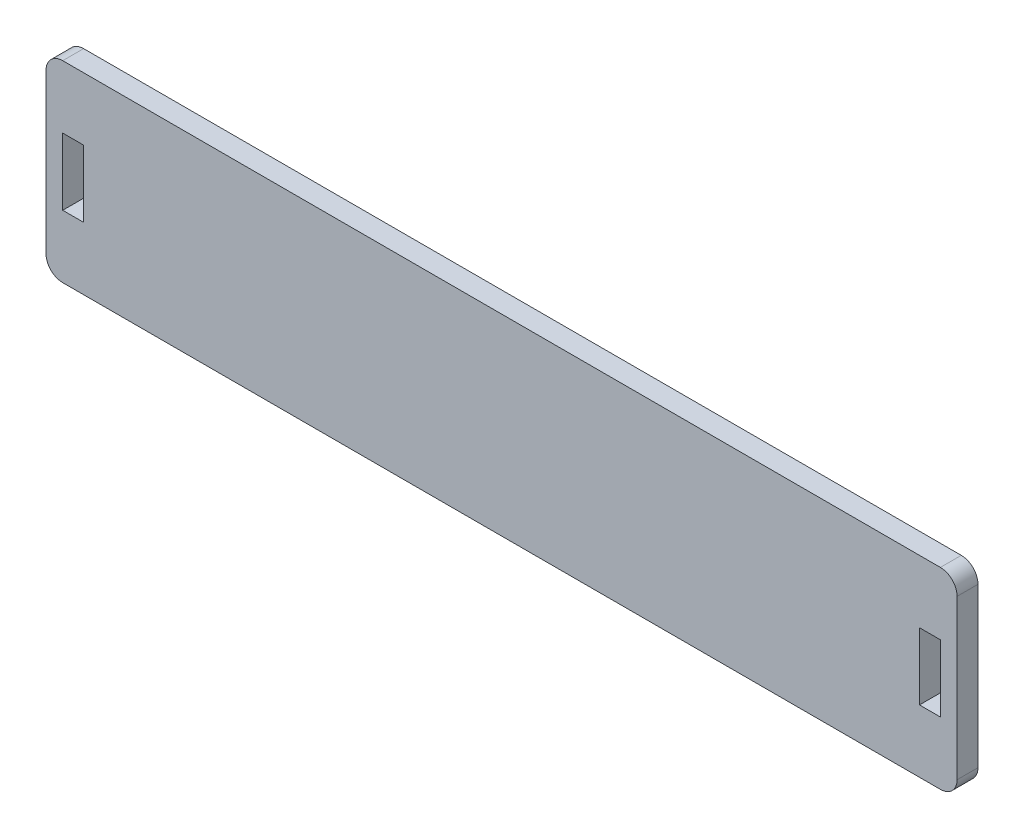
from build123d import *

# Parameters (mm, degrees)
SKETCH1_W           = 109
SKETCH1_H           = 23
SKETCH1_W_2         = 2.5
SKETCH1_H_2         = 8
BOSS_EXTRUDE1_DEPTH = 2.5
FILLET1_R           = 2
SKETCH2_W           = 0.269230769
SKETCH2_H           = 3
SKETCH2_W_2         = 0.157051282
SKETCH2_H_2         = 1.75
CUT_EXTRUDE1_DEPTH  = 1


with BuildPart() as part:
    # Sketch1 → Boss-Extrude1 (new body)
    with BuildSketch(Plane.XY):
        Rectangle(SKETCH1_W, SKETCH1_H)
        with Locations((51.25, 0)):
            Rectangle(SKETCH1_W_2, SKETCH1_H_2, mode=Mode.SUBTRACT)
        with Locations((-51.25, 0)):
            Rectangle(SKETCH1_W_2, SKETCH1_H_2, mode=Mode.SUBTRACT)
    extrude(amount=BOSS_EXTRUDE1_DEPTH)

    # Fillet1
    fillet1_edges = [part.edges().sort_by_distance(p)[0] for p in [
        (-54.5, -11.5, 1.25),
        (54.5, -11.5, 1.25),
        (54.5, 11.5, 1.25),
        (-54.5, 11.5, 1.25),
    ]]
    fillet(fillet1_edges, radius=FILLET1_R)

    # Sketch2 → Cut-Extrude1 (cut)
    # profile 1 of 19: a face of its own
    with BuildSketch(Plane(origin=(0, 0, 0), x_dir=(-1, 0, 0), z_dir=(0, 0, -1))):
        with BuildLine():
            add(Edge.make_bspline(
                [(-7.807692308, 4.576923077), (-7.752142503, 4.575516095), (-7.643038102, 4.572752665), (-7.48268819, 4.551599148), (-7.32960668, 4.515003099), (-7.182546561, 4.4662634), (-7.043266867, 4.401245355), (-6.910719244, 4.322658085), (-6.785219067, 4.229678264), (-6.668457883, 4.123024641), (-6.561609068, 4.00698168), (-6.467472594, 3.883143472), (-6.3885792, 3.752258784), (-6.323791382, 3.614720929), (-6.272964002, 3.470840956), (-6.237890536, 3.319851811), (-6.215486408, 3.162731791), (-6.21286717, 3.055565907), (-6.211538462, 3.001201923)],
                knots=[0, 0, 0, 0, 1.065120563, 2.091984664, 3.0946048, 4.079830382, 5.057816894, 6.036188127, 7.030412546, 8.04752943, 9.064399622, 10.05169764, 11.02544977, 11.989514704, 12.962713494, 13.945757189, 14.957906945, 16, 16, 16, 16], degree=3))
            add(Edge.make_bspline(
                [(-6.211538462, 3.001201923), (-6.212866975, 2.947238398), (-6.215485629, 2.840870037), (-6.23791601, 2.684747085), (-6.27309401, 2.534669345), (-6.323319381, 2.390887357), (-6.387798363, 2.253249445), (-6.467217081, 2.122117771), (-6.56076669, 1.997449343), (-6.667229705, 1.880609916), (-6.783287741, 1.773469227), (-6.907770827, 1.680110191), (-7.037879387, 1.599775227), (-7.175287708, 1.535674935), (-7.318173454, 1.48444186), (-7.467815445, 1.449511034), (-7.623512492, 1.426979283), (-7.729687638, 1.424391984), (-7.783653846, 1.423076923)],
                knots=[0, 0, 0, 0, 1.043624062, 2.057103931, 3.04512605, 4.022047818, 4.998200453, 5.980619268, 6.982898556, 8.009068085, 9.034988726, 10.034168286, 11.015286542, 11.987931943, 12.962482838, 13.94673481, 14.956375938, 16, 16, 16, 16], degree=3))
            add(Edge.make_bspline(
                [(-7.783653846, 1.423076923), (-7.838017548, 1.424404969), (-7.945182876, 1.427022901), (-8.102500335, 1.449464105), (-8.253595544, 1.484556651), (-8.398036416, 1.534707596), (-8.535903499, 1.599522366), (-8.667466427, 1.678554691), (-8.792197125, 1.77233224), (-8.909061479, 1.878760733), (-9.015989363, 1.994622063), (-9.109211685, 2.11876571), (-9.188261782, 2.248756102), (-9.252858924, 2.384953979), (-9.303999889, 2.52670093), (-9.338889733, 2.674942482), (-9.361463407, 2.828833487), (-9.364064704, 2.933613115), (-9.365384615, 2.986778846)],
                knots=[0, 0, 0, 0, 1.053102029, 2.075944431, 3.073151272, 4.055350789, 5.033113405, 6.020478099, 7.024410459, 8.052272461, 9.079885166, 10.07527673, 11.055994387, 12.023226415, 12.992069828, 13.970394897, 14.97016774, 16, 16, 16, 16], degree=3))
            add(Edge.make_bspline(
                [(-9.365384615, 2.986778846), (-9.364926356, 3.022463991), (-9.36401562, 3.093384097), (-9.353051312, 3.198698326), (-9.337141282, 3.302318889), (-9.314339643, 3.403951131), (-9.284518214, 3.50334626), (-9.249330762, 3.601189771), (-9.206353752, 3.696490106), (-9.157770339, 3.789698727), (-9.103545932, 3.879362647), (-9.043652433, 3.964116575), (-8.980193545, 4.044671715), (-8.910624922, 4.118940576), (-8.837239398, 4.18908371), (-8.758846502, 4.254023181), (-8.675924578, 4.314344568), (-8.588116824, 4.36870486), (-8.497586874, 4.417869833), (-8.404263922, 4.460059991), (-8.309415432, 4.496270901), (-8.212597163, 4.525620179), (-8.114066215, 4.548790496), (-8.013607543, 4.564568228), (-7.911301177, 4.5755605), (-7.84237719, 4.576466931), (-7.807692308, 4.576923077)],
                knots=[0, 0, 0, 0, 1.037015668, 2.060948919, 3.074880161, 4.083647147, 5.086022904, 6.090072063, 7.104153813, 8.122640571, 9.144368836, 10.147691507, 11.138137339, 12.123020368, 13.103399296, 14.087645067, 15.080126199, 16.082011238, 17.087798457, 18.072939717, 19.057185487, 20.037253025, 21.01195951, 21.997135196, 22.992090687, 24, 24, 24, 24], degree=3))
        make_face()
        with BuildLine():
            add(Edge.make_bspline(
                [(-7.794471154, 4.269230769), (-7.82294084, 4.26888372), (-7.879608039, 4.268192941), (-7.963851928, 4.259093756), (-8.046987871, 4.24612528), (-8.129033038, 4.227626833), (-8.209644144, 4.202423359), (-8.289572579, 4.173416867), (-8.368089482, 4.138084503), (-8.444935646, 4.098165042), (-8.519434282, 4.053980253), (-8.589730883, 4.00514731), (-8.656007435, 3.952811406), (-8.718101664, 3.896850403), (-8.77583124, 3.836979316), (-8.830332413, 3.774105799), (-8.879420625, 3.70643275), (-8.924408263, 3.635795258), (-8.964666412, 3.562285331), (-9.000465287, 3.486676878), (-9.029748723, 3.408353146), (-9.05363076, 3.328163868), (-9.073430598, 3.246236046), (-9.085973961, 3.161948175), (-9.095173127, 3.075723794), (-9.095824423, 3.017453633), (-9.096153846, 2.987980769)],
                knots=[0, 0, 0, 0, 1.008559885, 2.007477868, 2.99961109, 3.989939068, 4.984837346, 5.991145699, 7.001802488, 8.033829008, 9.059044045, 10.069351652, 11.065060232, 12.050310815, 13.029377138, 14.011219647, 14.996725999, 15.989392538, 16.977580475, 17.965360261, 18.951710183, 19.937753436, 20.929683414, 21.935841486, 22.955955122, 24, 24, 24, 24], degree=3))
            add(Edge.make_bspline(
                [(-9.096153846, 2.987980769), (-9.095061107, 2.944641723), (-9.092911352, 2.859380411), (-9.074090578, 2.734436288), (-9.045100314, 2.614360614), (-9.002365428, 2.499810406), (-8.948922044, 2.389801021), (-8.882898996, 2.285308359), (-8.804676922, 2.186304181), (-8.715822471, 2.093479665), (-8.618688722, 2.00875469), (-8.515546382, 1.934386054), (-8.407500433, 1.871462983), (-8.294269116, 1.820201492), (-8.17645694, 1.779581717), (-8.053304754, 1.75174289), (-7.925632931, 1.733421071), (-7.838606655, 1.731661566), (-7.794471154, 1.730769231)],
                knots=[0, 0, 0, 0, 1.032063989, 2.030389145, 3.003944642, 3.970395727, 4.937377036, 5.913328081, 6.909231446, 7.93887556, 8.970685674, 9.976071282, 10.964166581, 11.944589148, 12.933237628, 13.927779006, 14.949070134, 16, 16, 16, 16], degree=3))
            add(Edge.make_bspline(
                [(-7.794471154, 1.730769231), (-7.764805867, 1.731176806), (-7.705970693, 1.73198515), (-7.618460245, 1.740126873), (-7.532526349, 1.753182761), (-7.448289538, 1.771980466), (-7.365845414, 1.795506643), (-7.284849868, 1.823456124), (-7.206165619, 1.858325727), (-7.128800044, 1.896852543), (-7.054746123, 1.940772678), (-6.984052809, 1.987948235), (-6.918501969, 2.040207052), (-6.856454194, 2.095336606), (-6.798487603, 2.154448475), (-6.744994188, 2.217465808), (-6.696154075, 2.284786372), (-6.651183521, 2.35531672), (-6.611066439, 2.429027793), (-6.576112925, 2.504910374), (-6.546459111, 2.582777611), (-6.522520393, 2.662741815), (-6.503761426, 2.744651114), (-6.49083578, 2.828615181), (-6.481794261, 2.914466046), (-6.481112767, 2.972532208), (-6.480769231, 3.001802885)],
                knots=[0, 0, 0, 0, 1.047197238, 2.076906641, 3.100256066, 4.114471768, 5.12198147, 6.126382909, 7.136867548, 8.15857795, 9.17633901, 10.174870724, 11.156907918, 12.133735059, 13.104061851, 14.077631395, 15.04955518, 16.038496417, 17.029181396, 18.010275684, 18.986308667, 19.968651475, 20.955262928, 21.950658345, 22.966943676, 24, 24, 24, 24], degree=3))
            add(Edge.make_bspline(
                [(-6.480769231, 3.001802885), (-6.481113042, 3.030873317), (-6.481795055, 3.088539874), (-6.490831461, 3.173792004), (-6.503775082, 3.2571519), (-6.522428831, 3.338292302), (-6.54647182, 3.417233895), (-6.576118104, 3.493902536), (-6.611076932, 3.568583846), (-6.651198267, 3.641093244), (-6.696297544, 3.71067159), (-6.745578324, 3.777187944), (-6.79989148, 3.839393151), (-6.857685215, 3.898822889), (-6.920403117, 3.954209651), (-6.987761083, 4.005571812), (-7.058941379, 4.054148904), (-7.13430758, 4.097970814), (-7.212088112, 4.138440156), (-7.291900076, 4.173112445), (-7.372839304, 4.202574261), (-7.454699972, 4.227703089), (-7.538171096, 4.246052829), (-7.622688664, 4.259105443), (-7.708135743, 4.268189774), (-7.76560136, 4.26888267), (-7.794471154, 4.269230769)],
                knots=[0, 0, 0, 0, 1.02996197, 2.043119294, 3.035359645, 4.018872909, 4.991431989, 5.957985074, 6.929999688, 7.912076566, 8.892894881, 9.867085534, 10.843653904, 11.817741046, 12.803660682, 13.806313499, 14.818574707, 15.856120519, 16.894564902, 17.924820532, 18.937903209, 19.946497019, 20.957711757, 21.963978472, 22.977135795, 24, 24, 24, 24], degree=3))
        make_face(mode=Mode.SUBTRACT)
    # profile 2 of 19: a face of its own
    with BuildSketch(Plane(origin=(0, 0, 0), x_dir=(-1, 0, 0), z_dir=(0, 0, -1))):
        with BuildLine():
            Line((-5.596153846, 4.5), (-5.0078125, 4.5))
            add(Edge.make_bspline(
                [(-5.0078125, 4.5), (-4.967346009, 4.499955518), (-4.889810415, 4.499870287), (-4.778626082, 4.497286219), (-4.677646312, 4.493834769), (-4.587088842, 4.489050289), (-4.506675044, 4.483396069), (-4.436768787, 4.475465749), (-4.376820596, 4.467185496), (-4.340900782, 4.458767148), (-4.324519231, 4.454927885)],
                knots=[0, 0, 0, 0, 1.415646017, 2.712440637, 3.8905458, 4.950247383, 5.884950622, 6.709939814, 7.411656543, 8, 8, 8, 8], degree=3))
            add(Edge.make_bspline(
                [(-4.324519231, 4.454927885), (-4.303781916, 4.449251928), (-4.262795936, 4.43803376), (-4.203737899, 4.415564855), (-4.147548888, 4.388922999), (-4.094036124, 4.358559622), (-4.043857196, 4.323171995), (-3.996263446, 4.284194609), (-3.951674892, 4.24072755), (-3.91034227, 4.193258344), (-3.872383872, 4.142583879), (-3.839701287, 4.087947682), (-3.812335092, 4.030269422), (-3.788863717, 3.969589218), (-3.771970756, 3.905397512), (-3.759244842, 3.83814033), (-3.751167447, 3.767824881), (-3.750393822, 3.719773566), (-3.75, 3.6953125)],
                knots=[0, 0, 0, 0, 0.999701418, 1.975846123, 2.934577507, 3.890451536, 4.834027766, 5.787354733, 6.749476667, 7.726910423, 8.712836071, 9.690891519, 10.682875813, 11.679750201, 12.712814741, 13.765529915, 14.8625177, 16, 16, 16, 16], degree=3))
            add(Edge.make_bspline(
                [(-3.75, 3.6953125), (-3.750361221, 3.670645834), (-3.751067975, 3.622383837), (-3.759550505, 3.551778589), (-3.770976384, 3.484305684), (-3.788545286, 3.420114726), (-3.811555863, 3.359586923), (-3.838549051, 3.301797295), (-3.871106363, 3.247729005), (-3.908516217, 3.197185762), (-3.950131869, 3.150120122), (-3.995777244, 3.106873156), (-4.045268067, 3.067698009), (-4.098447051, 3.032506857), (-4.155832635, 3.00211576), (-4.216554481, 2.974895213), (-4.281140381, 2.952034304), (-4.325833964, 2.940008537), (-4.348557692, 2.933894231)],
                knots=[0, 0, 0, 0, 1.121902311, 2.195077645, 3.232258892, 4.234102512, 5.217864754, 6.176164875, 7.132989551, 8.084763148, 9.034132444, 9.988522005, 10.94243251, 11.903244335, 12.886203696, 13.894208494, 14.929344452, 16, 16, 16, 16], degree=3))
            add(Edge.make_bspline(
                [(-4.348557692, 2.933894231), (-4.36735255, 2.92989739), (-4.408542573, 2.921138081), (-4.476379192, 2.911359403), (-4.555360952, 2.903012888), (-4.645380049, 2.89675477), (-4.746355682, 2.891397312), (-4.858342474, 2.887138946), (-4.981560254, 2.884799071), (-5.067507035, 2.884678391), (-5.112379808, 2.884615385)],
                knots=[0, 0, 0, 0, 0.601384939, 1.31797006, 2.144135048, 3.087295005, 4.142315834, 5.309527816, 6.595305764, 8, 8, 8, 8], degree=3))
            Line((-5.112379808, 2.884615385), (-5.326923077, 2.884615385))
            Line((-5.326923077, 2.884615385), (-5.326923077, 1.5))
            Line((-5.326923077, 1.5), (-5.596153846, 1.5))
            Line((-5.596153846, 1.5), (-5.596153846, 4.5))
        make_face()
        with BuildLine():
            Line((-5.326923077, 4.192307692), (-5.326923077, 3.192307692))
            Line((-5.326923077, 3.192307692), (-4.801682692, 3.185697115))
            add(Edge.make_bspline(
                [(-4.801682692, 3.185697115), (-4.776037042, 3.185683861), (-4.726528642, 3.185658273), (-4.655011879, 3.189074179), (-4.588661061, 3.193017493), (-4.527679997, 3.198791142), (-4.472041196, 3.206952219), (-4.421651885, 3.215190852), (-4.376902786, 3.227109734), (-4.324532041, 3.243158079), (-4.266174886, 3.270528893), (-4.202688416, 3.31025737), (-4.148885056, 3.360897977), (-4.102326516, 3.417836118), (-4.065378621, 3.481178229), (-4.038330627, 3.548951603), (-4.022438207, 3.620461188), (-4.020307184, 3.669393879), (-4.019230769, 3.694110577)],
                knots=[0, 0, 0, 0, 1.160613943, 2.240541288, 3.23993089, 4.169200891, 5.011653406, 5.7853311, 6.478053781, 7.106038997, 8.262395093, 9.384106736, 10.481365981, 11.59014053, 12.70357646, 13.786202915, 14.881775077, 16, 16, 16, 16], degree=3))
            add(Edge.make_bspline(
                [(-4.019230769, 3.694110577), (-4.020313038, 3.718229303), (-4.022464453, 3.766174345), (-4.038455193, 3.836441854), (-4.065326034, 3.903501029), (-4.102574543, 3.966049388), (-4.147781226, 4.022782648), (-4.20032352, 4.0720659), (-4.260077744, 4.111684502), (-4.315661942, 4.137255887), (-4.365034387, 4.15286898), (-4.407918924, 4.163793129), (-4.456339503, 4.172515077), (-4.510311885, 4.179577508), (-4.569417743, 4.185623332), (-4.63416487, 4.189725598), (-4.704307992, 4.192126846), (-4.753002767, 4.192245951), (-4.778245192, 4.192307692)],
                knots=[0, 0, 0, 0, 1.120700087, 2.227813068, 3.331159281, 4.466773991, 5.599788987, 6.693661531, 7.80175334, 8.91857717, 9.525282508, 10.207424825, 10.974604443, 11.810962634, 12.737642355, 13.736264703, 14.826523623, 16, 16, 16, 16], degree=3))
            Line((-4.778245192, 4.192307692), (-5.326923077, 4.192307692))
        make_face(mode=Mode.SUBTRACT)
    # profile 3 of 19: a face of its own
    with BuildSketch(Plane(origin=(0, 0, 0), x_dir=(-1, 0, 0), z_dir=(0, 0, -1))):
        with BuildLine():
            Line((-3.134615385, 4.5), (-2.546274038, 4.5))
            add(Edge.make_bspline(
                [(-2.546274038, 4.5), (-2.505807547, 4.499955518), (-2.428271954, 4.499870287), (-2.31708762, 4.497286219), (-2.21610785, 4.493834769), (-2.125550381, 4.489050289), (-2.045136582, 4.483396069), (-1.975230326, 4.475465749), (-1.915282135, 4.467185496), (-1.879362321, 4.458767148), (-1.862980769, 4.454927885)],
                knots=[0, 0, 0, 0, 1.415646017, 2.712440637, 3.8905458, 4.950247383, 5.884950622, 6.709939814, 7.411656543, 8, 8, 8, 8], degree=3))
            add(Edge.make_bspline(
                [(-1.862980769, 4.454927885), (-1.842243455, 4.449251928), (-1.801257474, 4.43803376), (-1.742199437, 4.415564855), (-1.686010427, 4.388922999), (-1.632497662, 4.358559622), (-1.582318734, 4.323171995), (-1.534724985, 4.284194609), (-1.49013643, 4.24072755), (-1.448803808, 4.193258344), (-1.410845411, 4.142583879), (-1.378162825, 4.087947682), (-1.350796631, 4.030269422), (-1.327325255, 3.969589218), (-1.310432294, 3.905397512), (-1.29770638, 3.83814033), (-1.289628985, 3.767824881), (-1.288855361, 3.719773566), (-1.288461538, 3.6953125)],
                knots=[0, 0, 0, 0, 0.999701418, 1.975846123, 2.934577507, 3.890451536, 4.834027766, 5.787354733, 6.749476667, 7.726910423, 8.712836071, 9.690891519, 10.682875813, 11.679750201, 12.712814741, 13.765529915, 14.8625177, 16, 16, 16, 16], degree=3))
            add(Edge.make_bspline(
                [(-1.288461538, 3.6953125), (-1.28882276, 3.670645834), (-1.289529513, 3.622383837), (-1.298012044, 3.551778589), (-1.309437922, 3.484305684), (-1.327006824, 3.420114726), (-1.350017401, 3.359586923), (-1.377010589, 3.301797295), (-1.409567901, 3.247729005), (-1.446977755, 3.197185762), (-1.488593407, 3.150120122), (-1.534238783, 3.106873156), (-1.583729605, 3.067698009), (-1.636908589, 3.032506857), (-1.694294174, 3.00211576), (-1.75501602, 2.974895213), (-1.81960192, 2.952034304), (-1.864295503, 2.940008537), (-1.887019231, 2.933894231)],
                knots=[0, 0, 0, 0, 1.121902311, 2.195077645, 3.232258892, 4.234102512, 5.217864754, 6.176164875, 7.132989551, 8.084763148, 9.034132444, 9.988522005, 10.94243251, 11.903244335, 12.886203696, 13.894208494, 14.929344452, 16, 16, 16, 16], degree=3))
            add(Edge.make_bspline(
                [(-1.887019231, 2.933894231), (-1.905814088, 2.92989739), (-1.947004112, 2.921138081), (-2.014840731, 2.911359403), (-2.09382249, 2.903012888), (-2.183841587, 2.89675477), (-2.28481722, 2.891397312), (-2.396804012, 2.887138946), (-2.520021793, 2.884799071), (-2.605968573, 2.884678391), (-2.650841346, 2.884615385)],
                knots=[0, 0, 0, 0, 0.601384939, 1.31797006, 2.144135048, 3.087295005, 4.142315834, 5.309527816, 6.595305764, 8, 8, 8, 8], degree=3))
            Line((-2.650841346, 2.884615385), (-2.865384615, 2.884615385))
            Line((-2.865384615, 2.884615385), (-2.865384615, 1.5))
            Line((-2.865384615, 1.5), (-3.134615385, 1.5))
            Line((-3.134615385, 1.5), (-3.134615385, 4.5))
        make_face()
        with BuildLine():
            Line((-2.865384615, 4.192307692), (-2.865384615, 3.192307692))
            Line((-2.865384615, 3.192307692), (-2.340144231, 3.185697115))
            add(Edge.make_bspline(
                [(-2.340144231, 3.185697115), (-2.31449858, 3.185683861), (-2.26499018, 3.185658273), (-2.193473417, 3.189074179), (-2.1271226, 3.193017493), (-2.066141535, 3.198791142), (-2.010502734, 3.206952219), (-1.960113424, 3.215190852), (-1.915364324, 3.227109734), (-1.86299358, 3.243158079), (-1.804636425, 3.270528893), (-1.741149954, 3.31025737), (-1.687346595, 3.360897977), (-1.640788055, 3.417836118), (-1.603840159, 3.481178229), (-1.576792166, 3.548951603), (-1.560899745, 3.620461188), (-1.558768722, 3.669393879), (-1.557692308, 3.694110577)],
                knots=[0, 0, 0, 0, 1.160613943, 2.240541288, 3.23993089, 4.169200891, 5.011653406, 5.7853311, 6.478053781, 7.106038997, 8.262395093, 9.384106736, 10.481365981, 11.59014053, 12.70357646, 13.786202915, 14.881775077, 16, 16, 16, 16], degree=3))
            add(Edge.make_bspline(
                [(-1.557692308, 3.694110577), (-1.558774576, 3.718229303), (-1.560925992, 3.766174345), (-1.576916732, 3.836441854), (-1.603787572, 3.903501029), (-1.641036082, 3.966049388), (-1.686242765, 4.022782648), (-1.738785059, 4.0720659), (-1.798539283, 4.111684502), (-1.854123481, 4.137255887), (-1.903495926, 4.15286898), (-1.946380463, 4.163793129), (-1.994801041, 4.172515077), (-2.048773423, 4.179577508), (-2.107879281, 4.185623332), (-2.172626408, 4.189725598), (-2.242769531, 4.192126846), (-2.291464306, 4.192245951), (-2.316706731, 4.192307692)],
                knots=[0, 0, 0, 0, 1.120700087, 2.227813068, 3.331159281, 4.466773991, 5.599788987, 6.693661531, 7.80175334, 8.91857717, 9.525282508, 10.207424825, 10.974604443, 11.810962634, 12.737642355, 13.736264703, 14.826523623, 16, 16, 16, 16], degree=3))
            Line((-2.316706731, 4.192307692), (-2.865384615, 4.192307692))
        make_face(mode=Mode.SUBTRACT)
    # profile 4 of 19: a face of its own
    with BuildSketch(Plane(origin=(0, 0, 0), x_dir=(-1, 0, 0), z_dir=(0, 0, -1))):
        with BuildLine():
            add(Edge.make_bspline(
                [(0.730769231, 4.576923077), (0.786319036, 4.575516095), (0.895423436, 4.572752665), (1.055773348, 4.551599148), (1.208854859, 4.515003099), (1.355914978, 4.4662634), (1.495194672, 4.401245355), (1.627742294, 4.322658085), (1.753242472, 4.229678264), (1.870003656, 4.123024641), (1.97685247, 4.00698168), (2.070988944, 3.883143472), (2.149882339, 3.752258784), (2.214670156, 3.614720929), (2.265497536, 3.470840956), (2.300571002, 3.319851811), (2.322975131, 3.162731791), (2.325594369, 3.055565907), (2.326923077, 3.001201923)],
                knots=[0, 0, 0, 0, 1.065120563, 2.091984664, 3.0946048, 4.079830382, 5.057816894, 6.036188127, 7.030412546, 8.04752943, 9.064399622, 10.05169764, 11.02544977, 11.989514704, 12.962713494, 13.945757189, 14.957906945, 16, 16, 16, 16], degree=3))
            add(Edge.make_bspline(
                [(2.326923077, 3.001201923), (2.325594563, 2.947238398), (2.322975909, 2.840870037), (2.300545528, 2.684747085), (2.265367528, 2.534669345), (2.215142157, 2.390887357), (2.150663176, 2.253249445), (2.071244458, 2.122117771), (1.977694849, 1.997449343), (1.871231833, 1.880609916), (1.755173797, 1.773469227), (1.630690712, 1.680110191), (1.500582152, 1.599775227), (1.36317383, 1.535674935), (1.220288084, 1.48444186), (1.070646093, 1.449511034), (0.914949047, 1.426979283), (0.808773901, 1.424391984), (0.754807692, 1.423076923)],
                knots=[0, 0, 0, 0, 1.043624062, 2.057103931, 3.04512605, 4.022047818, 4.998200453, 5.980619268, 6.982898556, 8.009068085, 9.034988726, 10.034168286, 11.015286542, 11.987931943, 12.962482838, 13.94673481, 14.956375938, 16, 16, 16, 16], degree=3))
            add(Edge.make_bspline(
                [(0.754807692, 1.423076923), (0.70044399, 1.424404969), (0.593278662, 1.427022901), (0.435961203, 1.449464105), (0.284865994, 1.484556651), (0.140425122, 1.534707596), (0.002558039, 1.599522366), (-0.129004889, 1.678554691), (-0.253735586, 1.77233224), (-0.37059994, 1.878760733), (-0.477527824, 1.994622063), (-0.570750146, 2.11876571), (-0.649800244, 2.248756102), (-0.714397386, 2.384953979), (-0.765538351, 2.52670093), (-0.800428195, 2.674942482), (-0.823001868, 2.828833487), (-0.825603165, 2.933613115), (-0.826923077, 2.986778846)],
                knots=[0, 0, 0, 0, 1.053102029, 2.075944431, 3.073151272, 4.055350789, 5.033113405, 6.020478099, 7.024410459, 8.052272461, 9.079885166, 10.07527673, 11.055994387, 12.023226415, 12.992069828, 13.970394897, 14.97016774, 16, 16, 16, 16], degree=3))
            add(Edge.make_bspline(
                [(-0.826923077, 2.986778846), (-0.826464818, 3.022463991), (-0.825554081, 3.093384097), (-0.814589773, 3.198698326), (-0.798679744, 3.302318889), (-0.775878104, 3.403951131), (-0.746056675, 3.50334626), (-0.710869223, 3.601189771), (-0.667892213, 3.696490106), (-0.6193088, 3.789698727), (-0.565084394, 3.879362647), (-0.505190894, 3.964116575), (-0.441732007, 4.044671715), (-0.372163384, 4.118940576), (-0.298777859, 4.18908371), (-0.220384964, 4.254023181), (-0.13746304, 4.314344568), (-0.049655286, 4.36870486), (0.040874664, 4.417869833), (0.134197616, 4.460059991), (0.229046106, 4.496270901), (0.325864376, 4.525620179), (0.424395323, 4.548790496), (0.524853996, 4.564568228), (0.627160361, 4.5755605), (0.696084349, 4.576466931), (0.730769231, 4.576923077)],
                knots=[0, 0, 0, 0, 1.037015668, 2.060948919, 3.074880161, 4.083647147, 5.086022904, 6.090072063, 7.104153813, 8.122640571, 9.144368836, 10.147691507, 11.138137339, 12.123020368, 13.103399296, 14.087645067, 15.080126199, 16.082011238, 17.087798457, 18.072939717, 19.057185487, 20.037253025, 21.01195951, 21.997135196, 22.992090687, 24, 24, 24, 24], degree=3))
        make_face()
        with BuildLine():
            add(Edge.make_bspline(
                [(0.743990385, 4.269230769), (0.715520699, 4.26888372), (0.658853499, 4.268192941), (0.574609611, 4.259093756), (0.491473668, 4.24612528), (0.4094285, 4.227626833), (0.328817395, 4.202423359), (0.24888896, 4.173416867), (0.170372056, 4.138084503), (0.093525892, 4.098165042), (0.019027256, 4.053980253), (-0.051269345, 4.00514731), (-0.117545897, 3.952811406), (-0.179640125, 3.896850403), (-0.237369701, 3.836979316), (-0.291870874, 3.774105799), (-0.340959087, 3.70643275), (-0.385946724, 3.635795258), (-0.426204873, 3.562285331), (-0.462003749, 3.486676878), (-0.491287185, 3.408353146), (-0.515169221, 3.328163868), (-0.534969059, 3.246236046), (-0.547512423, 3.161948175), (-0.556711588, 3.075723794), (-0.557362884, 3.017453633), (-0.557692308, 2.987980769)],
                knots=[0, 0, 0, 0, 1.008559885, 2.007477868, 2.99961109, 3.989939068, 4.984837346, 5.991145699, 7.001802488, 8.033829008, 9.059044045, 10.069351652, 11.065060232, 12.050310815, 13.029377138, 14.011219647, 14.996725999, 15.989392538, 16.977580475, 17.965360261, 18.951710183, 19.937753436, 20.929683414, 21.935841486, 22.955955122, 24, 24, 24, 24], degree=3))
            add(Edge.make_bspline(
                [(-0.557692308, 2.987980769), (-0.556599569, 2.944641723), (-0.554449814, 2.859380411), (-0.535629039, 2.734436288), (-0.506638775, 2.614360614), (-0.46390389, 2.499810406), (-0.410460506, 2.389801021), (-0.344437457, 2.285308359), (-0.266215384, 2.186304181), (-0.177360932, 2.093479665), (-0.080227184, 2.00875469), (0.022915156, 1.934386054), (0.130961105, 1.871462983), (0.244192422, 1.820201492), (0.362004598, 1.779581717), (0.485156785, 1.75174289), (0.612828607, 1.733421071), (0.699854883, 1.731661566), (0.743990385, 1.730769231)],
                knots=[0, 0, 0, 0, 1.032063989, 2.030389145, 3.003944642, 3.970395727, 4.937377036, 5.913328081, 6.909231446, 7.93887556, 8.970685674, 9.976071282, 10.964166581, 11.944589148, 12.933237628, 13.927779006, 14.949070134, 16, 16, 16, 16], degree=3))
            add(Edge.make_bspline(
                [(0.743990385, 1.730769231), (0.773655672, 1.731176806), (0.832490846, 1.73198515), (0.920001293, 1.740126873), (1.005935189, 1.753182761), (1.090172001, 1.771980466), (1.172616125, 1.795506643), (1.25361167, 1.823456124), (1.332295919, 1.858325727), (1.409661494, 1.896852543), (1.483715416, 1.940772678), (1.554408729, 1.987948235), (1.619959569, 2.040207052), (1.682007344, 2.095336606), (1.739973935, 2.154448475), (1.79346735, 2.217465808), (1.842307463, 2.284786372), (1.887278018, 2.35531672), (1.9273951, 2.429027793), (1.962348613, 2.504910374), (1.992002427, 2.582777611), (2.015941145, 2.662741815), (2.034700113, 2.744651114), (2.047625758, 2.828615181), (2.056667277, 2.914466046), (2.057348772, 2.972532208), (2.057692308, 3.001802885)],
                knots=[0, 0, 0, 0, 1.047197238, 2.076906641, 3.100256066, 4.114471768, 5.12198147, 6.126382909, 7.136867548, 8.15857795, 9.17633901, 10.174870724, 11.156907918, 12.133735059, 13.104061851, 14.077631395, 15.04955518, 16.038496417, 17.029181396, 18.010275684, 18.986308667, 19.968651475, 20.955262928, 21.950658345, 22.966943676, 24, 24, 24, 24], degree=3))
            add(Edge.make_bspline(
                [(2.057692308, 3.001802885), (2.057348497, 3.030873317), (2.056666484, 3.088539874), (2.047630077, 3.173792004), (2.034686457, 3.2571519), (2.016032707, 3.338292302), (1.991989718, 3.417233895), (1.962343435, 3.493902536), (1.927384607, 3.568583846), (1.887263272, 3.641093244), (1.842163994, 3.71067159), (1.792883214, 3.777187944), (1.738570059, 3.839393151), (1.680776323, 3.898822889), (1.618058421, 3.954209651), (1.550700455, 4.005571812), (1.47952016, 4.054148904), (1.404153958, 4.097970814), (1.326373426, 4.138440156), (1.246561462, 4.173112445), (1.165622234, 4.202574261), (1.083761566, 4.227703089), (1.000290442, 4.246052829), (0.915772875, 4.259105443), (0.830325796, 4.268189774), (0.772860179, 4.26888267), (0.743990385, 4.269230769)],
                knots=[0, 0, 0, 0, 1.02996197, 2.043119294, 3.035359645, 4.018872909, 4.991431989, 5.957985074, 6.929999688, 7.912076566, 8.892894881, 9.867085534, 10.843653904, 11.817741046, 12.803660682, 13.806313499, 14.818574707, 15.856120519, 16.894564902, 17.924820532, 18.937903209, 19.946497019, 20.957711757, 21.963978472, 22.977135795, 24, 24, 24, 24], degree=3))
        make_face(mode=Mode.SUBTRACT)
    # profile 5 of 19: a face of its own
    with BuildSketch(Plane(origin=(0, 0, 0), x_dir=(-1, 0, 0), z_dir=(0, 0, -1))):
        with BuildLine():
            Line((2.634615385, 2.078725962), (2.888221154, 2.230769231))
            add(Edge.make_bspline(
                [(2.888221154, 2.230769231), (2.911808214, 2.191285472), (2.957000112, 2.115636115), (3.032386991, 2.013414937), (3.110500915, 1.926533088), (3.191920344, 1.855495996), (3.276148299, 1.799568379), (3.363734631, 1.759966466), (3.454384183, 1.735267059), (3.51607603, 1.732266985), (3.546875, 1.730769231)],
                knots=[0, 0, 0, 0, 1.272034388, 2.437168799, 3.508375237, 4.49857839, 5.41946034, 6.295179144, 7.148887113, 8, 8, 8, 8], degree=3))
            add(Edge.make_bspline(
                [(3.546875, 1.730769231), (3.573178023, 1.731501807), (3.625323829, 1.732954142), (3.702091466, 1.746909115), (3.776647296, 1.768348083), (3.8474547, 1.799051738), (3.913536655, 1.836199012), (3.971485251, 1.881067164), (4.02158192, 1.931301054), (4.062561161, 1.98734333), (4.094001191, 2.047615171), (4.118165821, 2.109480273), (4.131575884, 2.173910474), (4.133595959, 2.217290871), (4.134615385, 2.239182692)],
                knots=[0, 0, 0, 0, 1.095163259, 2.171163733, 3.241058638, 4.321873601, 5.38011039, 6.391990106, 7.366004449, 8.327778327, 9.272591725, 10.192022065, 11.087607919, 12, 12, 12, 12], degree=3))
            add(Edge.make_bspline(
                [(4.134615385, 2.239182692), (4.13335169, 2.264160563), (4.130782783, 2.314936926), (4.109070085, 2.389850914), (4.074913588, 2.463987402), (4.043402751, 2.50984563), (4.027043269, 2.533653846)],
                knots=[0, 0, 0, 0, 0.938893495, 1.908633276, 2.914225137, 4, 4, 4, 4], degree=3))
            add(Edge.make_bspline(
                [(4.027043269, 2.533653846), (4.013611314, 2.550836838), (3.985412605, 2.586910379), (3.936934737, 2.640606296), (3.880049496, 2.695993512), (3.816703592, 2.755186989), (3.744589516, 2.815433672), (3.665965932, 2.879606482), (3.578825481, 2.945264976), (3.517711627, 2.989298604), (3.486177885, 3.012019231)],
                knots=[0, 0, 0, 0, 0.722233717, 1.516239348, 2.393582979, 3.351407094, 4.387010283, 5.505090956, 6.712668013, 8, 8, 8, 8], degree=3))
            add(Edge.make_bspline(
                [(3.486177885, 3.012019231), (3.454614459, 3.034500877), (3.394267594, 3.077484074), (3.309874523, 3.141276317), (3.234407841, 3.199599634), (3.168202969, 3.253003073), (3.111289029, 3.301493877), (3.063217534, 3.344606396), (3.025213056, 3.383506591), (3.004079702, 3.408742027), (2.994591346, 3.420072115)],
                knots=[0, 0, 0, 0, 1.452282411, 2.77665338, 3.964542531, 5.026858415, 5.96415736, 6.766646006, 7.446254459, 8, 8, 8, 8], degree=3))
            add(Edge.make_bspline(
                [(2.994591346, 3.420072115), (2.981329165, 3.437730147), (2.955247304, 3.472457036), (2.9208193, 3.526735485), (2.89155716, 3.582298284), (2.868618018, 3.63929474), (2.849301259, 3.696924679), (2.836308747, 3.755940032), (2.828173264, 3.816075991), (2.827340133, 3.856544706), (2.826923077, 3.876802885)],
                knots=[0, 0, 0, 0, 1.068054152, 2.10047183, 3.106115577, 4.101338837, 5.06977816, 6.043150881, 7.020423561, 8, 8, 8, 8], degree=3))
            add(Edge.make_bspline(
                [(2.826923077, 3.876802885), (2.828041827, 3.908542691), (2.830255416, 3.971343889), (2.848975859, 4.063084601), (2.878524054, 4.150672958), (2.919919672, 4.233241816), (2.973283118, 4.308641228), (3.03503681, 4.377738503), (3.108589512, 4.435825859), (3.189291761, 4.486579052), (3.277625794, 4.52630413), (3.370189426, 4.556270685), (3.467129773, 4.573250049), (3.532789603, 4.575686704), (3.566105769, 4.576923077)],
                knots=[0, 0, 0, 0, 1.005424448, 1.989358655, 2.955360095, 3.929531133, 4.905563448, 5.876582895, 6.856512386, 7.866279853, 8.892233794, 9.918561126, 10.94386622, 12, 12, 12, 12], degree=3))
            add(Edge.make_bspline(
                [(3.566105769, 4.576923077), (3.601457855, 4.575703747), (3.671761871, 4.573278889), (3.775175484, 4.552195291), (3.874741813, 4.517309001), (3.95483604, 4.477718722), (4.017521264, 4.438177509), (4.065326463, 4.402160517), (4.113769992, 4.360696138), (4.163242611, 4.313673927), (4.212906033, 4.260662426), (4.263497564, 4.202024693), (4.315135508, 4.138119073), (4.348354817, 4.092498073), (4.365384615, 4.069110577)],
                knots=[0, 0, 0, 0, 1.286793592, 2.559021753, 3.825965368, 5.121522368, 5.803751409, 6.523245864, 7.299691795, 8.125521123, 9.008227632, 9.944561021, 10.946284179, 12, 12, 12, 12], degree=3))
            Line((4.365384615, 4.069110577), (4.121995192, 3.884615385))
            add(Edge.make_bspline(
                [(4.121995192, 3.884615385), (4.107298679, 3.903548548), (4.07899663, 3.940009393), (4.036028498, 3.991070521), (3.995529657, 4.037713218), (3.955629314, 4.078226185), (3.918434773, 4.114828013), (3.882334451, 4.146164948), (3.847847865, 4.17254403), (3.804376227, 4.200695652), (3.74976104, 4.228601227), (3.681202866, 4.252214722), (3.609557487, 4.266404775), (3.56076066, 4.268280965), (3.536057692, 4.269230769)],
                knots=[0, 0, 0, 0, 1.181633172, 2.275549214, 3.290209073, 4.226197932, 5.078386478, 5.862611352, 6.581680152, 7.217281963, 8.414376989, 9.595101626, 10.782541182, 12, 12, 12, 12], degree=3))
            add(Edge.make_bspline(
                [(3.536057692, 4.269230769), (3.505066387, 4.268192169), (3.445302575, 4.266189327), (3.360453802, 4.244315054), (3.28408758, 4.209873459), (3.218471096, 4.161603478), (3.163839401, 4.104414056), (3.124320436, 4.038603609), (3.100534581, 3.965932978), (3.097632056, 3.91524013), (3.096153846, 3.889423077)],
                knots=[0, 0, 0, 0, 1.14458467, 2.207223713, 3.21896685, 4.227309161, 5.202851033, 6.127160689, 7.046193047, 8, 8, 8, 8], degree=3))
            add(Edge.make_bspline(
                [(3.096153846, 3.889423077), (3.096490812, 3.873350381), (3.097165294, 3.841178707), (3.106572264, 3.793648917), (3.118657403, 3.746239197), (3.13780823, 3.699162698), (3.164247062, 3.651596104), (3.198965784, 3.602720329), (3.24269148, 3.552104579), (3.276186062, 3.519183973), (3.293870192, 3.501802885)],
                knots=[0, 0, 0, 0, 0.858281714, 1.717966888, 2.583508476, 3.4729293, 4.427298488, 5.488583878, 6.674047936, 8, 8, 8, 8], degree=3))
            add(Edge.make_bspline(
                [(3.293870192, 3.501802885), (3.300437083, 3.495942577), (3.316038512, 3.482019827), (3.344560734, 3.459226443), (3.38222599, 3.431109781), (3.428050733, 3.396320653), (3.482879901, 3.355965114), (3.54671952, 3.310559161), (3.618857977, 3.258628767), (3.670048191, 3.222322304), (3.697115385, 3.203125)],
                knots=[0, 0, 0, 0, 0.420754252, 0.999615792, 1.744751191, 2.668019286, 3.750313428, 4.999500688, 6.413464383, 8, 8, 8, 8], degree=3))
            add(Edge.make_bspline(
                [(3.697115385, 3.203125), (3.729674739, 3.179432406), (3.792721416, 3.133554982), (3.882427913, 3.064627256), (3.963765463, 2.997214883), (4.037019637, 2.931748363), (4.10291413, 2.868724283), (4.160717891, 2.807384414), (4.211019902, 2.748168209), (4.265173518, 2.672248858), (4.320508792, 2.579007929), (4.368030084, 2.464769439), (4.397994382, 2.350086878), (4.401912824, 2.273006733), (4.403846154, 2.234975962)],
                knots=[0, 0, 0, 0, 1.163667725, 2.253281268, 3.268753668, 4.215851969, 5.092017293, 5.902905408, 6.650798638, 7.335211899, 8.59617414, 9.77448103, 10.901945474, 12, 12, 12, 12], degree=3))
            add(Edge.make_bspline(
                [(4.403846154, 2.234975962), (4.403282893, 2.20808022), (4.402167308, 2.154811034), (4.389343668, 2.076592397), (4.370555383, 2.00062308), (4.342237754, 1.927842126), (4.307675047, 1.856918044), (4.263818263, 1.789711272), (4.212983105, 1.724734359), (4.154668449, 1.663719938), (4.090857676, 1.607708913), (4.023414509, 1.557884003), (3.952228561, 1.516339726), (3.877686004, 1.482439004), (3.799769715, 1.455924561), (3.7185059, 1.43671353), (3.633760605, 1.424922921), (3.576160192, 1.423699125), (3.546875, 1.423076923)],
                knots=[0, 0, 0, 0, 0.983748083, 1.948392443, 2.894712957, 3.844097841, 4.80183111, 5.778335162, 6.776009319, 7.81870978, 8.863265674, 9.881300176, 10.883814829, 11.87499822, 12.874611388, 13.892143829, 14.928324115, 16, 16, 16, 16], degree=3))
            add(Edge.make_bspline(
                [(3.546875, 1.423076923), (3.524216135, 1.423515079), (3.479183769, 1.424385872), (3.412575642, 1.432084112), (3.347313136, 1.442975915), (3.28421518, 1.460267975), (3.222468828, 1.481248241), (3.162342627, 1.507081098), (3.103807438, 1.538038699), (3.046535224, 1.573434435), (2.990671645, 1.614626787), (2.936740673, 1.66260407), (2.8829728, 1.716043074), (2.830955031, 1.776394985), (2.779635193, 1.842684771), (2.730025128, 1.915532642), (2.681097942, 1.994541803), (2.650398969, 2.050140447), (2.634615385, 2.078725962)],
                knots=[0, 0, 0, 0, 0.915332311, 1.819136955, 2.706846663, 3.586547465, 4.459518054, 5.340707479, 6.227863349, 7.133153174, 8.059268498, 9.028702269, 10.047606654, 11.120612155, 12.245963614, 13.433783089, 14.680604001, 16, 16, 16, 16], degree=3))
        make_face()
    # profile 6 of 19: a face of its own
    with BuildSketch(Plane(origin=(0, 0, 0), x_dir=(-1, 0, 0), z_dir=(0, 0, -1))):
        with Locations((5.153846153, 3)):
            Rectangle(SKETCH2_W, SKETCH2_H)
    # profile 7 of 19: a face of its own
    with BuildSketch(Plane(origin=(0, 0, 0), x_dir=(-1, 0, 0), z_dir=(0, 0, -1))):
        Polygon((5.711538462, 4.192307692), (5.711538462, 4.5), (7.288461538, 4.5), (7.288461538, 4.192307692), (6.634615385, 4.192307692), (6.634615385, 1.5), (6.365384615, 1.5), (6.365384615, 4.192307692), align=None)
    # profile 8 of 19: a face of its own
    with BuildSketch(Plane(origin=(0, 0, 0), x_dir=(-1, 0, 0), z_dir=(0, 0, -1))):
        Polygon((7.75, 4.5), (9.442307692, 4.5), (9.442307692, 4.192307692), (8.019230769, 4.192307692), (8.019230769, 3.269230769), (9.442307692, 3.269230769), (9.442307692, 2.961538462), (8.019230769, 2.961538462), (8.019230769, 1.807692308), (9.442307692, 1.807692308), (9.442307692, 1.5), (7.75, 1.5), align=None)
    # profile 9 of 19: a face of its own
    with BuildSketch(Plane(origin=(0, 0, 0), x_dir=(-1, 0, 0), z_dir=(0, 0, -1))):
        Polygon((8.144230769, -0.705128205), (8.301282051, -0.705128205), (8.301282051, -1.221153846), (8.525641026, -1.221153846), (8.525641026, -1.378205128), (8.301282051, -1.378205128), (8.301282051, -2.5), (8.144230769, -2.5), (8.144230769, -1.378205128), (7.919871795, -1.378205128), (7.919871795, -1.221153846), (8.144230769, -1.221153846), align=None)
    # profile 10 of 19: a face of its own
    with BuildSketch(Plane(origin=(0, 0, 0), x_dir=(-1, 0, 0), z_dir=(0, 0, -1))):
        with BuildLine():
            Line((6.326923077, -1.221153846), (6.483974359, -1.221153846))
            Line((6.483974359, -1.221153846), (6.483974359, -1.457782452))
            add(Edge.make_bspline(
                [(6.483974359, -1.457782452), (6.500653101, -1.436313585), (6.533064898, -1.394593139), (6.588927351, -1.340598074), (6.647890755, -1.295060422), (6.711472461, -1.259369156), (6.778684306, -1.23245875), (6.849250465, -1.212569025), (6.923769848, -1.200848288), (6.974718074, -1.199437457), (7.000701122, -1.198717949)],
                knots=[0, 0, 0, 0, 1.0828784, 2.104357462, 3.088488658, 4.04616522, 5.001424249, 5.969181776, 6.964304535, 8, 8, 8, 8], degree=3))
            add(Edge.make_bspline(
                [(7.000701122, -1.198717949), (7.023396923, -1.199374538), (7.068256368, -1.200672322), (7.134287982, -1.209458849), (7.197875674, -1.224517695), (7.258659701, -1.246218153), (7.317291233, -1.273045888), (7.372902283, -1.306904406), (7.426359061, -1.346107501), (7.476317156, -1.391223576), (7.522477839, -1.44003771), (7.56240093, -1.492548862), (7.596836882, -1.547030155), (7.62467203, -1.604326201), (7.646476204, -1.663985816), (7.661983543, -1.726250036), (7.671212365, -1.790888007), (7.67245059, -1.834839367), (7.673076923, -1.857071314)],
                knots=[0, 0, 0, 0, 1.041296284, 2.058176809, 3.050446431, 4.034000596, 5.01514041, 6.003636468, 7.015969324, 8.052561599, 9.08815499, 10.094063707, 11.074456064, 12.040834395, 13.011057502, 13.983766392, 14.980127149, 16, 16, 16, 16], degree=3))
            add(Edge.make_bspline(
                [(7.673076923, -1.857071314), (7.67246418, -1.879772468), (7.671255763, -1.924542421), (7.66188326, -1.990285969), (7.646904823, -2.053529656), (7.625375732, -2.114168288), (7.597554987, -2.172160114), (7.563702707, -2.227463312), (7.523759474, -2.280060163), (7.47810891, -2.329236613), (7.428582442, -2.37453627), (7.375643697, -2.414155304), (7.320114234, -2.447425992), (7.262278151, -2.475217472), (7.201640331, -2.496163564), (7.138483693, -2.511272464), (7.072842619, -2.520589712), (7.028192043, -2.521815783), (7.005608974, -2.522435897)],
                knots=[0, 0, 0, 0, 1.038740735, 2.04854663, 3.033179607, 4.009277356, 4.987731542, 5.972001279, 6.972200261, 8.005528982, 9.039189865, 10.040446548, 11.026516639, 11.997840187, 12.972163198, 13.956796175, 14.96660207, 16, 16, 16, 16], degree=3))
            add(Edge.make_bspline(
                [(7.005608974, -2.522435897), (6.980195188, -2.521788494), (6.92999551, -2.520509681), (6.856596675, -2.507549976), (6.785958249, -2.488181508), (6.718862837, -2.459832011), (6.654778931, -2.423704254), (6.594069028, -2.379649151), (6.536410651, -2.327758838), (6.501706273, -2.28839293), (6.483974359, -2.268279247)],
                knots=[0, 0, 0, 0, 1.014726462, 2.004382257, 2.969841629, 3.936926163, 4.907207904, 5.903978561, 6.929055279, 8, 8, 8, 8], degree=3))
            Line((6.483974359, -2.268279247), (6.483974359, -2.971153846))
            Line((6.483974359, -2.971153846), (6.326923077, -2.971153846))
            Line((6.326923077, -2.971153846), (6.326923077, -1.221153846))
        make_face()
        with BuildLine():
            add(Edge.make_bspline(
                [(6.999298878, -1.355769231), (6.981509097, -1.35608936), (6.946485603, -1.356719612), (6.895149494, -1.364206586), (6.84570178, -1.375075457), (6.798640804, -1.391531407), (6.753515496, -1.411730813), (6.710673413, -1.436971819), (6.67014463, -1.466797822), (6.632031114, -1.500637494), (6.597599468, -1.537924838), (6.567118004, -1.577718742), (6.541514351, -1.619968812), (6.520263341, -1.664281493), (6.5040917, -1.711004136), (6.49261384, -1.759870642), (6.485398663, -1.810934499), (6.484454195, -1.845712502), (6.483974359, -1.86338141)],
                knots=[0, 0, 0, 0, 1.05670511, 2.080379991, 3.077984906, 4.06214886, 5.038337365, 6.01289324, 7.01187578, 8.025460281, 9.038092164, 10.024533457, 11.000252242, 11.969694649, 12.940728589, 13.933144304, 14.949937299, 16, 16, 16, 16], degree=3))
            add(Edge.make_bspline(
                [(6.483974359, -1.86338141), (6.484769787, -1.886575467), (6.486328098, -1.932014587), (6.498996782, -1.998406648), (6.519614414, -2.061232476), (6.548878771, -2.119962994), (6.585852558, -2.173954412), (6.630401636, -2.222299715), (6.682122912, -2.264695011), (6.740156507, -2.300405638), (6.802367573, -2.329399671), (6.867260529, -2.350156776), (6.933942969, -2.36294289), (6.979027129, -2.3645663), (7.001752804, -2.365384615)],
                knots=[0, 0, 0, 0, 1.03728447, 2.032128127, 3.01272805, 3.987917167, 4.958271349, 5.931593992, 6.91984656, 7.941419022, 8.973179163, 9.983609215, 10.983593296, 12, 12, 12, 12], degree=3))
            add(Edge.make_bspline(
                [(7.001752804, -2.365384615), (7.024020688, -2.364606427), (7.068218435, -2.363061863), (7.133297496, -2.349692769), (7.196542815, -2.329270257), (7.256632901, -2.299490478), (7.313044645, -2.262995449), (7.363985422, -2.219215433), (7.408488879, -2.168470461), (7.446421056, -2.11196621), (7.476986799, -2.051378518), (7.499951919, -1.988687824), (7.513206205, -1.924115112), (7.5150846, -1.880616256), (7.516025641, -1.858824119)],
                knots=[0, 0, 0, 0, 1.00104056, 1.986885549, 2.97790532, 3.984399681, 4.995088187, 5.994304198, 6.996462723, 8.023150851, 9.048424203, 10.043036403, 11.019596776, 12, 12, 12, 12], degree=3))
            add(Edge.make_bspline(
                [(7.516025641, -1.858824119), (7.515298274, -1.836896624), (7.513849207, -1.793212472), (7.499575688, -1.728831021), (7.478125699, -1.665887033), (7.446846174, -1.606126758), (7.409745539, -1.549739716), (7.36487204, -1.499962777), (7.314563942, -1.456377441), (7.25821936, -1.420369736), (7.197749147, -1.391726988), (7.134091689, -1.370785169), (7.067569888, -1.358198294), (7.022256061, -1.356586041), (6.999298878, -1.355769231)],
                knots=[0, 0, 0, 0, 0.983928682, 1.960191568, 2.949917689, 3.96440592, 4.982380491, 5.975291189, 6.965713506, 7.964880129, 8.970154049, 9.96478489, 10.968906225, 12, 12, 12, 12], degree=3))
        make_face(mode=Mode.SUBTRACT)
    # profile 11 of 19: a face of its own
    with BuildSketch(Plane(origin=(0, 0, 0), x_dir=(-1, 0, 0), z_dir=(0, 0, -1))):
        Polygon((4.913461538, -1.221153846), (5.082782452, -1.221153846), (5.51572516, -2.200620994), (5.955328526, -1.221153846), (6.125, -1.221153846), (5.33974359, -2.971153846), (5.170072115, -2.971153846), (5.430538862, -2.390975561), align=None)
    # profile 12 of 19: a face of its own
    with BuildSketch(Plane(origin=(0, 0, 0), x_dir=(-1, 0, 0), z_dir=(0, 0, -1))):
        with BuildLine():
            Line((4.532051282, -1.221153846), (4.689102564, -1.221153846))
            Line((4.689102564, -1.221153846), (4.689102564, -2.236027644))
            add(Edge.make_bspline(
                [(4.689102564, -2.236027644), (4.688964043, -2.257646442), (4.688696663, -2.299375928), (4.686771178, -2.359715068), (4.682710839, -2.41544811), (4.678106498, -2.46682924), (4.67148314, -2.513620295), (4.663394957, -2.555960897), (4.654277117, -2.593891678), (4.646267008, -2.617254099), (4.642477965, -2.628305288)],
                knots=[0, 0, 0, 0, 1.307562039, 2.523909702, 3.650326591, 4.686913197, 5.643429486, 6.506965704, 7.293745905, 8, 8, 8, 8], degree=3))
            add(Edge.make_bspline(
                [(4.642477965, -2.628305288), (4.636883345, -2.642670249), (4.625861382, -2.670970668), (4.605218565, -2.711087828), (4.582101614, -2.748861023), (4.555698238, -2.784079749), (4.526127836, -2.816567205), (4.49408709, -2.847029205), (4.458951994, -2.874821288), (4.420742638, -2.899463937), (4.380339822, -2.921657464), (4.337766771, -2.940880748), (4.293263552, -2.957624169), (4.246412106, -2.970165567), (4.197946989, -2.981032928), (4.147298273, -2.988105271), (4.094761875, -2.9929188), (4.059039185, -2.993363916), (4.040915465, -2.993589744)],
                knots=[0, 0, 0, 0, 0.981931301, 1.934503488, 2.87077864, 3.801706999, 4.735015492, 5.667491629, 6.616593066, 7.585388521, 8.561939025, 9.551802639, 10.560317337, 11.588439944, 12.640189604, 13.723962949, 14.845264515, 16, 16, 16, 16], degree=3))
            add(Edge.make_bspline(
                [(4.040915465, -2.993589744), (4.014473097, -2.993161501), (3.96282405, -2.992325027), (3.887521553, -2.98257957), (3.816004194, -2.968802383), (3.749216965, -2.947949669), (3.687581917, -2.922431174), (3.631519979, -2.893133698), (3.581534425, -2.859539044), (3.536472589, -2.821288743), (3.495801794, -2.775806902), (3.457538149, -2.72220748), (3.420707678, -2.659674036), (3.399123359, -2.613777679), (3.387820513, -2.58974359)],
                knots=[0, 0, 0, 0, 1.157897085, 2.2616841, 3.32207898, 4.345638746, 5.321241055, 6.241986252, 7.112515963, 7.955008012, 8.825025602, 9.77857164, 10.836726669, 12, 12, 12, 12], degree=3))
            Line((3.387820513, -2.58974359), (3.544871795, -2.58974359))
            add(Edge.make_bspline(
                [(3.544871795, -2.58974359), (3.5575029, -2.609796528), (3.582195154, -2.648997552), (3.628369394, -2.69975413), (3.678972557, -2.743130812), (3.735712399, -2.778086199), (3.798825007, -2.804441095), (3.86834835, -2.823228743), (3.944848161, -2.834476877), (3.998107268, -2.835832524), (4.025841346, -2.836538462)],
                knots=[0, 0, 0, 0, 0.997731894, 1.950442991, 2.880492273, 3.800895997, 4.748200782, 5.754801363, 6.83083817, 8, 8, 8, 8], degree=3))
            add(Edge.make_bspline(
                [(4.025841346, -2.836538462), (4.053224791, -2.835823387), (4.106017333, -2.834444795), (4.181932917, -2.823223723), (4.251230386, -2.804437006), (4.313510487, -2.778132813), (4.368038371, -2.74590761), (4.415044366, -2.709907573), (4.453116705, -2.669317071), (4.478723188, -2.631926168), (4.494640497, -2.598614103), (4.504776615, -2.569937805), (4.5130136, -2.537511367), (4.519903519, -2.501443498), (4.525588975, -2.46168267), (4.529190416, -2.418137968), (4.531793322, -2.370908357), (4.531963307, -2.338161788), (4.532051282, -2.321213942)],
                knots=[0, 0, 0, 0, 1.570740765, 3.028230971, 4.391408896, 5.680370741, 6.894727393, 8.017376726, 9.065722033, 10.075533815, 10.603371122, 11.180248986, 11.817768598, 12.521299649, 13.286540596, 14.121245857, 15.027658897, 16, 16, 16, 16], degree=3))
            Line((4.532051282, -2.321213942), (4.532051282, -2.254957933))
            add(Edge.make_bspline(
                [(4.532051282, -2.254957933), (4.516110723, -2.273928834), (4.484509995, -2.311536944), (4.429936332, -2.360817762), (4.370327874, -2.403260827), (4.305786103, -2.438070144), (4.237891982, -2.465910857), (4.167380867, -2.485382337), (4.094884839, -2.497962287), (4.045758764, -2.499315945), (4.020933494, -2.5)],
                knots=[0, 0, 0, 0, 1.012485704, 2.007162095, 2.997754123, 3.998611389, 4.999708251, 5.992315798, 6.98544096, 8, 8, 8, 8], degree=3))
            add(Edge.make_bspline(
                [(4.020933494, -2.5), (4.006315359, -2.499742487), (3.97725208, -2.499230508), (3.934074706, -2.494751119), (3.891534487, -2.488251748), (3.849730636, -2.478711028), (3.808602829, -2.466465165), (3.768219033, -2.451156796), (3.72825227, -2.433849237), (3.689429021, -2.413462835), (3.652135955, -2.390781681), (3.616654363, -2.366212236), (3.583170093, -2.339883092), (3.552001848, -2.311534622), (3.523190513, -2.281207856), (3.496348579, -2.249226079), (3.471919905, -2.215142708), (3.449403211, -2.17957923), (3.429874435, -2.142298768), (3.412732249, -2.10410972), (3.397827547, -2.065093743), (3.385944846, -2.025120212), (3.376869289, -1.984214327), (3.370114176, -1.942443103), (3.36628271, -1.899677909), (3.365685248, -1.870867234), (3.365384615, -1.856370192)],
                knots=[0, 0, 0, 0, 1.028754217, 2.045334182, 3.052854819, 4.056607503, 5.061168794, 6.071104265, 7.095078842, 8.125279047, 9.155117945, 10.165957491, 11.161587969, 12.151493252, 13.128948131, 14.104219989, 15.088194871, 16.07871515, 17.064853787, 18.047899887, 19.02414258, 20.002704429, 20.980574569, 21.971845993, 22.979467364, 24, 24, 24, 24], degree=3))
            add(Edge.make_bspline(
                [(3.365384615, -1.856370192), (3.365644199, -1.841868644), (3.366162359, -1.812921715), (3.370637849, -1.769982022), (3.377021944, -1.727617305), (3.387125828, -1.686264234), (3.39928709, -1.645451858), (3.414348876, -1.60548163), (3.432458255, -1.566341375), (3.45296313, -1.528002109), (3.476005177, -1.490978302), (3.501271417, -1.455814979), (3.528792354, -1.422770893), (3.558188312, -1.391512682), (3.589818221, -1.362341935), (3.623665717, -1.335329453), (3.659397157, -1.31002244), (3.697123282, -1.286966771), (3.736261976, -1.266575648), (3.775818885, -1.24796935), (3.816318002, -1.23320229), (3.857004272, -1.22019074), (3.89859423, -1.210973143), (3.940577926, -1.203862022), (3.983099095, -1.199529661), (4.011575543, -1.198988869), (4.025841346, -1.198717949)],
                knots=[0, 0, 0, 0, 1.008818848, 2.013730394, 3.001654427, 3.987803273, 4.973046549, 5.963777569, 6.957074694, 7.972068341, 8.987420212, 9.989399531, 10.982630087, 11.977756091, 12.973280677, 13.973972381, 14.989194003, 16.018387222, 17.047741039, 18.059210846, 19.057554164, 20.045176975, 21.029480261, 22.018708529, 23.007435371, 24, 24, 24, 24], degree=3))
            add(Edge.make_bspline(
                [(4.025841346, -1.198717949), (4.049366816, -1.199396285), (4.095822389, -1.200735792), (4.164187891, -1.211246364), (4.230159011, -1.228003371), (4.294108018, -1.252011186), (4.356555844, -1.284786206), (4.417296672, -1.32795768), (4.476506239, -1.381912849), (4.513045154, -1.423289282), (4.532051282, -1.444811699)],
                knots=[0, 0, 0, 0, 0.96728863, 1.910097829, 2.838038873, 3.762875196, 4.71315279, 5.730631239, 6.819562287, 8, 8, 8, 8], degree=3))
            Line((4.532051282, -1.444811699), (4.532051282, -1.221153846))
        make_face()
        with BuildLine():
            add(Edge.make_bspline(
                [(4.038461538, -1.355769231), (4.015496187, -1.356549764), (3.970029659, -1.358095053), (3.903385488, -1.371287409), (3.839047021, -1.391960359), (3.778244307, -1.421531667), (3.721290752, -1.457578786), (3.670753342, -1.50124893), (3.626550884, -1.551122028), (3.589159415, -1.606747152), (3.559393732, -1.66675829), (3.538322022, -1.730013657), (3.52469701, -1.795491153), (3.523193184, -1.840177455), (3.522435897, -1.862680288)],
                knots=[0, 0, 0, 0, 1.026226791, 2.031711442, 3.026614839, 4.04107745, 5.047145931, 6.032893242, 7.017642609, 8.019221815, 9.021877557, 10.003543541, 10.994637589, 12, 12, 12, 12], degree=3))
            add(Edge.make_bspline(
                [(3.522435897, -1.862680288), (3.522798776, -1.879646925), (3.523512452, -1.913015337), (3.53037424, -1.961984284), (3.541464723, -2.008624441), (3.557183326, -2.052938628), (3.576659674, -2.095181026), (3.601155859, -2.135060643), (3.629981345, -2.172612996), (3.662910514, -2.207560337), (3.699198705, -2.239390821), (3.738558305, -2.267359841), (3.780935929, -2.290235202), (3.825289334, -2.310005621), (3.872694712, -2.324445155), (3.922469255, -2.335464544), (3.974965104, -2.341768923), (4.010750973, -2.342550322), (4.028996394, -2.342948718)],
                knots=[0, 0, 0, 0, 1.039728707, 2.044842319, 3.024901384, 3.974314358, 4.923051295, 5.871625912, 6.837440708, 7.820715446, 8.810779094, 9.792721783, 10.773906224, 11.758876063, 12.764959493, 13.806266761, 14.881525401, 16, 16, 16, 16], degree=3))
            add(Edge.make_bspline(
                [(4.028996394, -2.342948718), (4.047478273, -2.342564913), (4.083619392, -2.341814388), (4.13640486, -2.335362638), (4.18642123, -2.32495165), (4.233622642, -2.310170138), (4.278187312, -2.291309262), (4.319614619, -2.267440954), (4.358792843, -2.240258738), (4.394471048, -2.20855273), (4.426733131, -2.173610233), (4.454848514, -2.135587785), (4.478805739, -2.095057526), (4.498644574, -2.052024023), (4.513790176, -2.006152847), (4.523949629, -1.957558669), (4.531053001, -1.906474299), (4.531713463, -1.871469991), (4.532051282, -1.853565705)],
                knots=[0, 0, 0, 0, 1.121943988, 2.193949579, 3.223793937, 4.220241907, 5.192961521, 6.155822191, 7.11847367, 8.083710714, 9.04790392, 10.001595906, 10.949595423, 11.902125208, 12.873731292, 13.87582262, 14.913508608, 16, 16, 16, 16], degree=3))
            add(Edge.make_bspline(
                [(4.532051282, -1.853565705), (4.531381498, -1.830256778), (4.530072975, -1.784719326), (4.517724396, -1.718365942), (4.497814291, -1.655981605), (4.469890915, -1.597763617), (4.434899911, -1.544328842), (4.392754486, -1.49666692), (4.344181471, -1.454716491), (4.289320421, -1.419767395), (4.230296698, -1.391534677), (4.1685361, -1.370353791), (4.104130318, -1.358356634), (4.060477114, -1.356636662), (4.038461538, -1.355769231)],
                knots=[0, 0, 0, 0, 1.070913519, 2.092188694, 3.091357305, 4.074328408, 5.051968682, 6.018948707, 6.99050112, 7.9935919, 9.000589572, 9.992915277, 10.987769056, 12, 12, 12, 12], degree=3))
        make_face(mode=Mode.SUBTRACT)
    # profile 13 of 19: a face of its own
    with BuildSketch(Plane(origin=(0, 0, 0), x_dir=(-1, 0, 0), z_dir=(0, 0, -1))):
        Polygon((2.153846154, -0.75), (3.141025641, -0.75), (3.141025641, -0.929487179), (2.310897436, -0.929487179), (2.310897436, -1.467948718), (3.141025641, -1.467948718), (3.141025641, -1.647435897), (2.310897436, -1.647435897), (2.310897436, -2.320512821), (3.141025641, -2.320512821), (3.141025641, -2.5), (2.153846154, -2.5), align=None)
    # profile 14 of 19: a face of its own
    with BuildSketch(Plane(origin=(0, 0, 0), x_dir=(-1, 0, 0), z_dir=(0, 0, -1))):
        with BuildLine():
            Line((-0.044871795, -1.221153846), (0.112179487, -1.221153846))
            Line((0.112179487, -1.221153846), (0.112179487, -1.451822917))
            add(Edge.make_bspline(
                [(0.112179487, -1.451822917), (0.128948305, -1.430901555), (0.16148878, -1.390302924), (0.215680947, -1.336942636), (0.272952897, -1.292970024), (0.332953899, -1.257918127), (0.395765404, -1.231494814), (0.461004539, -1.212411848), (0.529061892, -1.200969434), (0.57534411, -1.199474319), (0.598758013, -1.198717949)],
                knots=[0, 0, 0, 0, 1.12780773, 2.188550248, 3.19190651, 4.159438251, 5.104880172, 6.052711206, 7.014878035, 8, 8, 8, 8], degree=3))
            add(Edge.make_bspline(
                [(0.598758013, -1.198717949), (0.62242333, -1.199590546), (0.668742064, -1.201298431), (0.736181094, -1.214806776), (0.799167791, -1.237879404), (0.857477569, -1.269485439), (0.910041176, -1.308788676), (0.956203602, -1.354577567), (0.994385225, -1.407245608), (1.019983907, -1.456107186), (1.036846731, -1.499451583), (1.047462899, -1.536574958), (1.05647839, -1.577934034), (1.064294264, -1.623403829), (1.06958282, -1.673302924), (1.073753966, -1.72742677), (1.076743313, -1.785757835), (1.076861916, -1.826101149), (1.076923077, -1.846905048)],
                knots=[0, 0, 0, 0, 1.235846778, 2.418850247, 3.575807741, 4.728682307, 5.871620074, 6.994088408, 8.11269785, 9.256955736, 9.865816715, 10.540099792, 11.271859618, 12.076849838, 12.949306005, 13.892391288, 14.913166135, 16, 16, 16, 16], degree=3))
            Line((1.076923077, -1.846905048), (1.076923077, -2.5))
            Line((1.076923077, -2.5), (0.919871795, -2.5))
            Line((0.919871795, -2.5), (0.919871795, -1.8984375))
            add(Edge.make_bspline(
                [(0.919871795, -1.8984375), (0.919775191, -1.881026278), (0.919590404, -1.847721572), (0.91900758, -1.800037061), (0.917602677, -1.756793771), (0.915628521, -1.718095088), (0.912739005, -1.683978169), (0.90972769, -1.654373531), (0.906045201, -1.62931876), (0.902763745, -1.614236219), (0.901292067, -1.607471955)],
                knots=[0, 0, 0, 0, 1.430800155, 2.736877192, 3.918605307, 4.986035426, 5.920637409, 6.731861385, 7.431261377, 8, 8, 8, 8], degree=3))
            add(Edge.make_bspline(
                [(0.901292067, -1.607471955), (0.895979302, -1.587616363), (0.885753871, -1.54940049), (0.86048688, -1.497563314), (0.828579789, -1.45346422), (0.789630865, -1.417375859), (0.744016327, -1.389290441), (0.691862755, -1.369803464), (0.633673435, -1.357615329), (0.592746244, -1.356401763), (0.571414263, -1.355769231)],
                knots=[0, 0, 0, 0, 1.084156227, 2.086665306, 3.027808233, 3.945421172, 4.874247719, 5.839848303, 6.874090471, 8, 8, 8, 8], degree=3))
            add(Edge.make_bspline(
                [(0.571414263, -1.355769231), (0.558780421, -1.356007233), (0.533778375, -1.356478234), (0.496703389, -1.361203883), (0.460741302, -1.36893311), (0.425531197, -1.379367429), (0.391777301, -1.393698564), (0.358395155, -1.409963249), (0.326641773, -1.430237355), (0.295840074, -1.452832666), (0.267183671, -1.477872269), (0.240519501, -1.504294524), (0.216750491, -1.532432326), (0.195216154, -1.5618323), (0.176627022, -1.592898219), (0.160400478, -1.625330372), (0.14663263, -1.659171447), (0.139791284, -1.682658977), (0.136368189, -1.694411058)],
                knots=[0, 0, 0, 0, 1.023777757, 2.026029729, 3.023749952, 4.003683103, 4.997618607, 5.993177895, 7.010360494, 8.046726602, 9.087585522, 10.09234134, 11.086953743, 12.070360549, 13.043493632, 14.017870808, 15.008233677, 16, 16, 16, 16], degree=3))
            add(Edge.make_bspline(
                [(0.136368189, -1.694411058), (0.134398365, -1.703038659), (0.13011016, -1.721820496), (0.12547857, -1.752642706), (0.121274783, -1.788297694), (0.117756303, -1.828743852), (0.115603595, -1.87412279), (0.113256397, -1.924240709), (0.112401866, -1.979297453), (0.112255689, -2.017628299), (0.112179487, -2.037610176)],
                knots=[0, 0, 0, 0, 0.615963638, 1.340920617, 2.168419149, 3.115676021, 4.16674242, 5.331190069, 6.6087489, 8, 8, 8, 8], degree=3))
            Line((0.112179487, -2.037610176), (0.112179487, -2.5))
            Line((0.112179487, -2.5), (-0.044871795, -2.5))
            Line((-0.044871795, -2.5), (-0.044871795, -1.221153846))
        make_face()
    # profile 15 of 19: a face of its own
    with BuildSketch(Plane(origin=(0, 0, 0), x_dir=(-1, 0, 0), z_dir=(0, 0, -1))):
        with Locations((-0.52724359, -1.625)):
            Rectangle(SKETCH2_W_2, SKETCH2_H_2)
    # profile 16 of 19: a face of its own
    with BuildSketch(Plane(origin=(0, 0, 0), x_dir=(-1, 0, 0), z_dir=(0, 0, -1))):
        with BuildLine():
            Line((-1.844651442, -2.096153846), (-1.705128205, -2.169421074))
            add(Edge.make_bspline(
                [(-1.705128205, -2.169421074), (-1.716246503, -2.189142739), (-1.737878307, -2.227513291), (-1.775078681, -2.280229221), (-1.814074717, -2.327653079), (-1.856626701, -2.368517906), (-1.901461541, -2.404143599), (-1.948827868, -2.435312511), (-1.998972277, -2.461871771), (-2.051897139, -2.484248035), (-2.108046915, -2.501452782), (-2.167557673, -2.513604893), (-2.230543421, -2.521116527), (-2.273716511, -2.521989097), (-2.295823317, -2.522435897)],
                knots=[0, 0, 0, 0, 1.120438281, 2.179929193, 3.190490725, 4.156257408, 5.095198341, 6.022838206, 6.959905092, 7.901321166, 8.864066838, 9.862729781, 10.905609505, 12, 12, 12, 12], degree=3))
            add(Edge.make_bspline(
                [(-2.295823317, -2.522435897), (-2.320394306, -2.52186231), (-2.368325187, -2.520743406), (-2.43809506, -2.511097174), (-2.50378477, -2.495360995), (-2.565390621, -2.473378224), (-2.622761748, -2.444664562), (-2.676012175, -2.409684821), (-2.725421938, -2.368618694), (-2.769434043, -2.321110472), (-2.809055984, -2.270269493), (-2.844018894, -2.217291551), (-2.873247609, -2.162309939), (-2.897023915, -2.105674677), (-2.916226347, -2.04774273), (-2.929609699, -1.987986996), (-2.937324573, -1.926569204), (-2.938506796, -1.885020536), (-2.939102564, -1.864082532)],
                knots=[0, 0, 0, 0, 1.145258523, 2.234067595, 3.276747158, 4.290159414, 5.277019952, 6.260822364, 7.254936242, 8.264827045, 9.274100331, 10.257902744, 11.220704747, 12.172965371, 13.118907548, 14.062713208, 15.023725156, 16, 16, 16, 16], degree=3))
            add(Edge.make_bspline(
                [(-2.939102564, -1.864082532), (-2.938572993, -1.844435117), (-2.937523454, -1.805496534), (-2.930908061, -1.747863762), (-2.919183914, -1.691849536), (-2.903095752, -1.637407312), (-2.882320129, -1.584628245), (-2.856904019, -1.533480213), (-2.826807831, -1.484017643), (-2.803571494, -1.452816076), (-2.791866987, -1.437099359)],
                knots=[0, 0, 0, 0, 1.024358464, 2.0301432, 3.019427413, 4.004406732, 4.986367066, 5.972626655, 6.978780325, 8, 8, 8, 8], degree=3))
            add(Edge.make_bspline(
                [(-2.791866987, -1.437099359), (-2.776013146, -1.418164924), (-2.744807672, -1.380895849), (-2.692029495, -1.331926686), (-2.634879397, -1.290904798), (-2.574073584, -1.25690123), (-2.508905347, -1.231064407), (-2.440250701, -1.211810616), (-2.367327908, -1.20102161), (-2.317475298, -1.199497693), (-2.291967147, -1.198717949)],
                knots=[0, 0, 0, 0, 1.030682036, 2.02871468, 2.997146059, 3.962720338, 4.930598197, 5.918074684, 6.934738563, 8, 8, 8, 8], degree=3))
            add(Edge.make_bspline(
                [(-2.291967147, -1.198717949), (-2.265743345, -1.199394973), (-2.214298222, -1.200723141), (-2.139282161, -1.213036308), (-2.068301803, -1.232562585), (-2.001385551, -1.26013948), (-1.93852662, -1.295719256), (-1.880133596, -1.339790177), (-1.825207839, -1.39099922), (-1.79325355, -1.430380825), (-1.776993189, -1.450420673)],
                knots=[0, 0, 0, 0, 1.056321875, 2.072262726, 3.055038591, 4.01806755, 4.982017516, 5.957941055, 6.960871419, 8, 8, 8, 8], degree=3))
            add(Edge.make_bspline(
                [(-1.776993189, -1.450420673), (-1.76592972, -1.465522464), (-1.743876423, -1.495625523), (-1.716252873, -1.544711102), (-1.692274176, -1.596066399), (-1.673107695, -1.650521547), (-1.657587945, -1.707431337), (-1.646359535, -1.76720261), (-1.639774726, -1.829817566), (-1.638480377, -1.872480843), (-1.637820513, -1.894230769)],
                knots=[0, 0, 0, 0, 0.94817472, 1.890038105, 2.849395472, 3.817997239, 4.812318967, 5.836947057, 6.897266129, 8, 8, 8, 8], degree=3))
            Line((-1.637820513, -1.894230769), (-2.782051282, -1.894230769))
            add(Edge.make_bspline(
                [(-2.782051282, -1.894230769), (-2.781281479, -1.911081001), (-2.779767692, -1.944216303), (-2.77271012, -1.992701695), (-2.761585733, -2.038888366), (-2.745951202, -2.082429887), (-2.727017779, -2.123894951), (-2.703824921, -2.162975969), (-2.676155144, -2.199494934), (-2.645292294, -2.233778503), (-2.610938747, -2.264308883), (-2.574797373, -2.291634772), (-2.536350591, -2.31453757), (-2.495901549, -2.333127515), (-2.453515656, -2.347680673), (-2.409179559, -2.357614583), (-2.362980501, -2.364268137), (-2.331487634, -2.365007969), (-2.315454728, -2.365384615)],
                knots=[0, 0, 0, 0, 1.094153842, 2.151609401, 3.174256925, 4.172055639, 5.149267565, 6.128595816, 7.11444997, 8.118368179, 9.117203808, 10.09244225, 11.054858984, 12.015122123, 12.976791628, 13.957293641, 14.960065497, 16, 16, 16, 16], degree=3))
            add(Edge.make_bspline(
                [(-2.315454728, -2.365384615), (-2.299779154, -2.365080587), (-2.268675808, -2.364477337), (-2.22235538, -2.358611381), (-2.176785616, -2.349126243), (-2.132155124, -2.336181248), (-2.089369701, -2.320392822), (-2.049746926, -2.301341393), (-2.013306818, -2.28026652), (-1.979248335, -2.256161682), (-1.946212839, -2.226657589), (-1.913441595, -2.189839728), (-1.878303269, -2.146295965), (-1.856308472, -2.113523132), (-1.844651442, -2.096153846)],
                knots=[0, 0, 0, 0, 0.99110716, 1.966546729, 2.947904876, 3.932708344, 4.903319531, 5.828989031, 6.710028674, 7.56322171, 8.463672341, 9.504779593, 10.677557249, 12, 12, 12, 12], degree=3))
        make_face()
        with BuildLine():
            add(Edge.make_bspline(
                [(-1.794871795, -1.737179487), (-1.800620107, -1.71634805), (-1.811683758, -1.67625424), (-1.83480194, -1.620733795), (-1.86083771, -1.571389844), (-1.891648576, -1.528600028), (-1.926557939, -1.490598271), (-1.96688053, -1.457388979), (-2.012098477, -1.427680253), (-2.061978047, -1.402604003), (-2.11479894, -1.381259074), (-2.170102036, -1.366946516), (-2.22653093, -1.357141745), (-2.264698073, -1.356228691), (-2.283904247, -1.355769231)],
                knots=[0, 0, 0, 0, 1.154881502, 2.222775134, 3.210006277, 4.132804581, 5.035138423, 5.962687519, 6.919655026, 7.923214229, 8.944639381, 9.960483929, 10.97369054, 12, 12, 12, 12], degree=3))
            add(Edge.make_bspline(
                [(-2.283904247, -1.355769231), (-2.299578966, -1.356075067), (-2.330564591, -1.35667964), (-2.376215125, -1.362414704), (-2.420054974, -1.371894627), (-2.462407618, -1.384877105), (-2.502718052, -1.402181406), (-2.541815436, -1.42247302), (-2.578705634, -1.447243811), (-2.601776282, -1.466123239), (-2.61343149, -1.475661058)],
                knots=[0, 0, 0, 0, 1.04873581, 2.073130211, 3.073294108, 4.04793562, 5.032784715, 6.005352987, 6.992311501, 8, 8, 8, 8], degree=3))
            add(Edge.make_bspline(
                [(-2.61343149, -1.475661058), (-2.621778131, -1.483208216), (-2.638669698, -1.498481824), (-2.661239959, -1.524796427), (-2.682850196, -1.553172208), (-2.702517022, -1.58469477), (-2.720555815, -1.61900516), (-2.737435804, -1.655813977), (-2.75262901, -1.695400542), (-2.761177065, -1.722986762), (-2.76557492, -1.737179487)],
                knots=[0, 0, 0, 0, 0.879870761, 1.780643979, 2.707998968, 3.669668524, 4.684282772, 5.740141944, 6.837334558, 8, 8, 8, 8], degree=3))
            Line((-2.76557492, -1.737179487), (-1.794871795, -1.737179487))
        make_face(mode=Mode.SUBTRACT)
    # profile 17 of 19: a face of its own
    with BuildSketch(Plane(origin=(0, 0, 0), x_dir=(-1, 0, 0), z_dir=(0, 0, -1))):
        with BuildLine():
            Line((-3.253205128, -0.705128205), (-3.253205128, -2.5))
            Line((-3.253205128, -2.5), (-3.41025641, -2.5))
            Line((-3.41025641, -2.5), (-3.41025641, -2.278796074))
            add(Edge.make_bspline(
                [(-3.41025641, -2.278796074), (-3.427965806, -2.298815871), (-3.462525913, -2.337884756), (-3.520246472, -2.388925842), (-3.581430561, -2.431115003), (-3.645781222, -2.465189961), (-3.713240343, -2.490785989), (-3.783658387, -2.508979069), (-3.857064077, -2.520675986), (-3.907190255, -2.521843997), (-3.932592147, -2.522435897)],
                knots=[0, 0, 0, 0, 1.074387032, 2.096679803, 3.090159297, 4.057316773, 5.018401886, 5.985159533, 6.978961417, 8, 8, 8, 8], degree=3))
            add(Edge.make_bspline(
                [(-3.932592147, -2.522435897), (-3.955176124, -2.521822711), (-3.999712727, -2.520613481), (-4.065227265, -2.511232329), (-4.12827339, -2.496167018), (-4.188910676, -2.475216574), (-4.246746749, -2.447426163), (-4.302276797, -2.414155539), (-4.355213143, -2.374535124), (-4.404748913, -2.32924111), (-4.450364913, -2.280043616), (-4.490395549, -2.227570843), (-4.523772089, -2.172049691), (-4.55168213, -2.114183114), (-4.573180302, -2.053525654), (-4.588167119, -1.99028707), (-4.597537342, -1.924542133), (-4.598746073, -1.879772372), (-4.599358974, -1.857071314)],
                knots=[0, 0, 0, 0, 1.033919861, 2.038935746, 3.024066025, 3.998881131, 4.97069526, 5.957263378, 6.95902576, 7.993208707, 9.027059324, 10.027763471, 11.009749337, 11.988697705, 12.965288445, 13.950418724, 14.960734635, 16, 16, 16, 16], degree=3))
            add(Edge.make_bspline(
                [(-4.599358974, -1.857071314), (-4.598732489, -1.834839462), (-4.59749396, -1.790888291), (-4.58826735, -1.726248942), (-4.572751846, -1.663989811), (-4.550977922, -1.60431134), (-4.523056945, -1.547141315), (-4.489092901, -1.492439302), (-4.449083339, -1.440054603), (-4.402957135, -1.39121899), (-4.35298975, -1.346108683), (-4.299535385, -1.30690416), (-4.243923744, -1.273045736), (-4.185292239, -1.246218998), (-4.124508686, -1.224514445), (-4.061031964, -1.209497961), (-3.995126174, -1.200649301), (-3.950380928, -1.199367919), (-3.927684295, -1.198717949)],
                knots=[0, 0, 0, 0, 1.020392517, 2.01726096, 2.990465484, 3.961182959, 4.928053699, 5.906110375, 6.912531644, 7.948652711, 8.985773172, 9.998621852, 10.987621588, 11.969261332, 12.953316658, 13.946091881, 14.958173133, 16, 16, 16, 16], degree=3))
            add(Edge.make_bspline(
                [(-3.927684295, -1.198717949), (-3.901575891, -1.199501497), (-3.850327996, -1.201039514), (-3.775378735, -1.213892698), (-3.70448493, -1.235474137), (-3.637238436, -1.265019777), (-3.574040156, -1.303420153), (-3.514426836, -1.349795877), (-3.459435174, -1.40545945), (-3.426899263, -1.447265237), (-3.41025641, -1.46864984)],
                knots=[0, 0, 0, 0, 1.031072012, 2.023879775, 2.993683497, 3.952812103, 4.918022106, 5.908088563, 6.929940113, 8, 8, 8, 8], degree=3))
            Line((-3.41025641, -1.46864984), (-3.41025641, -0.705128205))
            Line((-3.41025641, -0.705128205), (-3.253205128, -0.705128205))
        make_face()
        with BuildLine():
            add(Edge.make_bspline(
                [(-3.925580929, -1.355769231), (-3.948538098, -1.35658605), (-3.993851898, -1.35819832), (-4.060373899, -1.370785068), (-4.124030606, -1.391727365), (-4.184503644, -1.420368316), (-4.240837752, -1.456382684), (-4.291184587, -1.499943375), (-4.335955938, -1.549861883), (-4.37361007, -1.605912938), (-4.404305319, -1.666001983), (-4.425888835, -1.728814202), (-4.440123458, -1.793216691), (-4.441577719, -1.836898034), (-4.442307692, -1.858824119)],
                knots=[0, 0, 0, 0, 1.031046209, 2.035121221, 3.029706178, 4.034933723, 5.034054252, 6.02443088, 7.017295772, 8.038157696, 9.050218397, 10.03989886, 11.016116709, 12, 12, 12, 12], degree=3))
            add(Edge.make_bspline(
                [(-4.442307692, -1.858824119), (-4.441375246, -1.880619172), (-4.439514007, -1.92412385), (-4.42613866, -1.988614138), (-4.403698723, -2.05144116), (-4.373077692, -2.112071656), (-4.33473438, -2.168363706), (-4.290290053, -2.219233768), (-4.239314913, -2.262978562), (-4.182851159, -2.299597349), (-4.122547174, -2.329178609), (-4.059130208, -2.349761429), (-3.993792389, -2.363050319), (-3.949366222, -2.364602558), (-3.926983173, -2.365384615)],
                knots=[0, 0, 0, 0, 0.979072187, 1.954306742, 2.945804271, 3.96968567, 4.997920485, 5.998718438, 6.996577872, 8.005894225, 9.015743152, 10.005417472, 10.995077863, 12, 12, 12, 12], degree=3))
            add(Edge.make_bspline(
                [(-3.926983173, -2.365384615), (-3.904259922, -2.364554633), (-3.859065628, -2.362903882), (-3.792346274, -2.350263249), (-3.727598793, -2.32937885), (-3.665705179, -2.300429286), (-3.608047113, -2.264550608), (-3.556298175, -2.222547063), (-3.51254019, -2.173695471), (-3.475443886, -2.120007244), (-3.446356177, -2.061151246), (-3.425168148, -1.998484151), (-3.412641195, -1.932003777), (-3.41106233, -1.886571813), (-3.41025641, -1.86338141)],
                knots=[0, 0, 0, 0, 1.01762866, 2.023962475, 3.030623092, 4.058876274, 5.077231937, 6.066672613, 7.034107872, 8.005628644, 8.981990164, 9.965428785, 10.961468474, 12, 12, 12, 12], degree=3))
            add(Edge.make_bspline(
                [(-3.41025641, -1.86338141), (-3.410736238, -1.845712495), (-3.411680692, -1.810934478), (-3.418895977, -1.75987072), (-3.43037344, -1.711003857), (-3.446546525, -1.664282512), (-3.467792167, -1.619965004), (-3.49341605, -1.577733124), (-3.523868775, -1.537806519), (-3.558660123, -1.500734983), (-3.596742724, -1.466921752), (-3.637039995, -1.436739632), (-3.680029368, -1.411945245), (-3.724987887, -1.391424609), (-3.771993554, -1.375095034), (-3.821428864, -1.364201188), (-3.872768357, -1.356721027), (-3.907791385, -1.356089837), (-3.925580929, -1.355769231)],
                knots=[0, 0, 0, 0, 1.050140795, 2.067009409, 3.05949893, 4.030605086, 5.00011959, 5.97591094, 6.962425594, 7.979863591, 8.993523472, 9.986985069, 10.967611495, 11.937549037, 12.921786183, 13.919465291, 14.943216303, 16, 16, 16, 16], degree=3))
        make_face(mode=Mode.SUBTRACT)
    # profile 18 of 19: a face of its own
    with BuildSketch(Plane(origin=(0, 0, 0), x_dir=(-1, 0, 0), z_dir=(0, 0, -1))):
        with BuildLine():
            Line((-4.913461538, -1.221153846), (-4.913461538, -2.5))
            Line((-4.913461538, -2.5), (-5.070512821, -2.5))
            Line((-5.070512821, -2.5), (-5.070512821, -2.278796074))
            add(Edge.make_bspline(
                [(-5.070512821, -2.278796074), (-5.088222216, -2.298815871), (-5.122782323, -2.337884756), (-5.180502882, -2.388925842), (-5.241686971, -2.431115003), (-5.306037632, -2.465189961), (-5.373496754, -2.490785989), (-5.443914797, -2.508979069), (-5.517320488, -2.520675986), (-5.567446665, -2.521843997), (-5.592848558, -2.522435897)],
                knots=[0, 0, 0, 0, 1.074387032, 2.096679803, 3.090159297, 4.057316773, 5.018401886, 5.985159533, 6.978961417, 8, 8, 8, 8], degree=3))
            add(Edge.make_bspline(
                [(-5.592848558, -2.522435897), (-5.615432535, -2.521822711), (-5.659969137, -2.520613481), (-5.725483676, -2.511232329), (-5.7885298, -2.496167018), (-5.849167087, -2.475216574), (-5.907003159, -2.447426163), (-5.962533208, -2.414155539), (-6.015469554, -2.374535124), (-6.065005323, -2.32924111), (-6.110621323, -2.280043616), (-6.15065196, -2.227570843), (-6.1840285, -2.172049691), (-6.21193854, -2.114183114), (-6.233436712, -2.053525654), (-6.248423529, -1.99028707), (-6.257793753, -1.924542133), (-6.259002483, -1.879772372), (-6.259615385, -1.857071314)],
                knots=[0, 0, 0, 0, 1.033919861, 2.038935746, 3.024066025, 3.998881131, 4.97069526, 5.957263378, 6.95902576, 7.993208707, 9.027059324, 10.027763471, 11.009749337, 11.988697705, 12.965288445, 13.950418724, 14.960734635, 16, 16, 16, 16], degree=3))
            add(Edge.make_bspline(
                [(-6.259615385, -1.857071314), (-6.258988899, -1.834839462), (-6.257750371, -1.790888291), (-6.248523761, -1.726248942), (-6.233008256, -1.663989811), (-6.211234332, -1.60431134), (-6.183313355, -1.547141315), (-6.149349311, -1.492439302), (-6.109339749, -1.440054603), (-6.063213546, -1.39121899), (-6.01324616, -1.346108683), (-5.959791795, -1.30690416), (-5.904180154, -1.273045736), (-5.845548649, -1.246218998), (-5.784765097, -1.224514445), (-5.721288374, -1.209497961), (-5.655382584, -1.200649301), (-5.610637338, -1.199367919), (-5.587940705, -1.198717949)],
                knots=[0, 0, 0, 0, 1.020392517, 2.01726096, 2.990465484, 3.961182959, 4.928053699, 5.906110375, 6.912531644, 7.948652711, 8.985773172, 9.998621852, 10.987621588, 11.969261332, 12.953316658, 13.946091881, 14.958173133, 16, 16, 16, 16], degree=3))
            add(Edge.make_bspline(
                [(-5.587940705, -1.198717949), (-5.561840776, -1.199436824), (-5.510660046, -1.200846506), (-5.435796041, -1.21257787), (-5.364973802, -1.232397103), (-5.297646626, -1.259355852), (-5.234056283, -1.295180217), (-5.174804791, -1.340370197), (-5.119272049, -1.394640791), (-5.087081903, -1.436326013), (-5.070512821, -1.457782452)],
                knots=[0, 0, 0, 0, 1.038897134, 2.037228247, 3.008116434, 3.962042015, 4.918381754, 5.904844433, 6.921570401, 8, 8, 8, 8], degree=3))
            Line((-5.070512821, -1.457782452), (-5.070512821, -1.221153846))
            Line((-5.070512821, -1.221153846), (-4.913461538, -1.221153846))
        make_face()
        with BuildLine():
            add(Edge.make_bspline(
                [(-5.58583734, -1.355769231), (-5.608794509, -1.35658605), (-5.654108309, -1.35819832), (-5.72063031, -1.370785068), (-5.784287017, -1.391727365), (-5.844760054, -1.420368316), (-5.901094162, -1.456382684), (-5.951440998, -1.499943375), (-5.996212348, -1.549861883), (-6.03386648, -1.605912938), (-6.064561729, -1.666001983), (-6.086145245, -1.728814202), (-6.100379869, -1.793216691), (-6.101834129, -1.836898034), (-6.102564103, -1.858824119)],
                knots=[0, 0, 0, 0, 1.031046209, 2.035121221, 3.029706178, 4.034933723, 5.034054252, 6.02443088, 7.017295772, 8.038157696, 9.050218397, 10.03989886, 11.016116709, 12, 12, 12, 12], degree=3))
            add(Edge.make_bspline(
                [(-6.102564103, -1.858824119), (-6.101631656, -1.880619172), (-6.099770417, -1.92412385), (-6.08639507, -1.988614138), (-6.063955134, -2.05144116), (-6.033334102, -2.112071656), (-5.99499079, -2.168363706), (-5.950546464, -2.219233768), (-5.899571323, -2.262978562), (-5.843107569, -2.299597349), (-5.782803584, -2.329178609), (-5.719386618, -2.349761429), (-5.654048799, -2.363050319), (-5.609622632, -2.364602558), (-5.587239583, -2.365384615)],
                knots=[0, 0, 0, 0, 0.979072187, 1.954306742, 2.945804271, 3.96968567, 4.997920485, 5.998718438, 6.996577872, 8.005894225, 9.015743152, 10.005417472, 10.995077863, 12, 12, 12, 12], degree=3))
            add(Edge.make_bspline(
                [(-5.587239583, -2.365384615), (-5.564516332, -2.364554633), (-5.519322039, -2.362903882), (-5.452602685, -2.350263249), (-5.387855203, -2.32937885), (-5.325961589, -2.300429286), (-5.268303524, -2.264550608), (-5.216554585, -2.222547063), (-5.172796601, -2.173695471), (-5.135700296, -2.120007244), (-5.106612587, -2.061151246), (-5.085424558, -1.998484151), (-5.072897605, -1.932003777), (-5.07131874, -1.886571813), (-5.070512821, -1.86338141)],
                knots=[0, 0, 0, 0, 1.01762866, 2.023962475, 3.030623092, 4.058876274, 5.077231937, 6.066672613, 7.034107872, 8.005628644, 8.981990164, 9.965428785, 10.961468474, 12, 12, 12, 12], degree=3))
            add(Edge.make_bspline(
                [(-5.070512821, -1.86338141), (-5.070992649, -1.845712495), (-5.071937102, -1.810934478), (-5.079152387, -1.75987072), (-5.09062985, -1.711003857), (-5.106802935, -1.664282512), (-5.128048578, -1.619965004), (-5.153672461, -1.577733124), (-5.184125185, -1.537806519), (-5.218916533, -1.500734983), (-5.256999135, -1.466921752), (-5.297296405, -1.436739632), (-5.340285779, -1.411945245), (-5.385244297, -1.391424609), (-5.432249964, -1.375095034), (-5.481685274, -1.364201188), (-5.533024768, -1.356721027), (-5.568047795, -1.356089837), (-5.58583734, -1.355769231)],
                knots=[0, 0, 0, 0, 1.050140795, 2.067009409, 3.05949893, 4.030605086, 5.00011959, 5.97591094, 6.962425594, 7.979863591, 8.993523472, 9.986985069, 10.967611495, 11.937549037, 12.921786183, 13.919465291, 14.943216303, 16, 16, 16, 16], degree=3))
        make_face(mode=Mode.SUBTRACT)
    # profile 19 of 19: a face of its own
    with BuildSketch(Plane(origin=(0, 0, 0), x_dir=(-1, 0, 0), z_dir=(0, 0, -1))):
        Polygon((-8.480769231, -2.5), (-8.249749599, -0.75), (-8.227313702, -0.75), (-7.504807692, -2.185897436), (-6.784054487, -0.75), (-6.761268029, -0.75), (-6.528846154, -2.5), (-6.686598558, -2.5), (-6.854166667, -1.240785256), (-7.485877404, -2.5), (-7.521284054, -2.5), (-8.155448718, -1.237980769), (-8.322666266, -2.5), align=None)
    extrude(amount=-CUT_EXTRUDE1_DEPTH, mode=Mode.SUBTRACT)


solid = part.part
